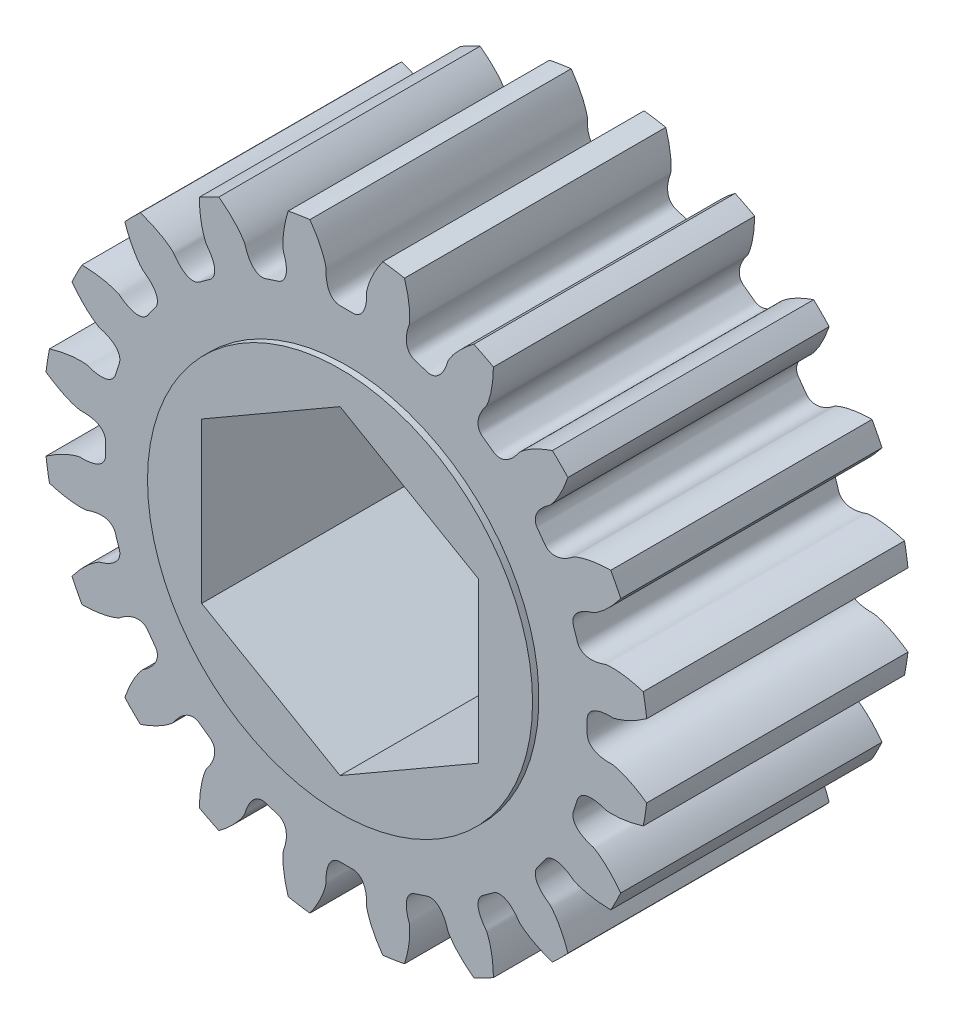
from build123d import *

# Parameters (mm, degrees)
BOSS_EXTRUDE1_DEPTH = 12.065
SKETCH2_R           = 8.89
BOSS_EXTRUDE2_DEPTH = 0.2921
BOSS_EXTRUDE3_START = 0.2921
SKETCH3_R           = 8.89
BOSS_EXTRUDE3_DEPTH = 0.2921
CUT_EXTRUDE1_DEPTH  = 24.338021171


with BuildPart() as part:
    # Sketch1 → Boss-Extrude1 (new body)
    with BuildSketch(Plane(origin=(0, 0, -6.0325), x_dir=(-1, 0, 0), z_dir=(0, 0, -1))):
        with BuildLine():
            ThreePointArc((-9.512675365, 10.230831217), (-9.878281733, 9.878281733), (-10.230831217, 9.512675365))
            add(Edge.make_bspline(
                [(-12.208592606, 6.790520347), (-12.095329691, 6.789049814), (-11.929946947, 6.782686734), (-11.715987182, 6.765537407), (-11.569261116, 6.749788038), (-11.431876081, 6.731285472), (-11.303867458, 6.710521074), (-11.185250935, 6.687985966), (-11.076022333, 6.664170625), (-10.976158721, 6.639562645), (-10.88561498, 6.614651246), (-10.80433542, 6.589909593), (-10.732217032, 6.565848579), (-10.669225937, 6.542844439), (-10.615038746, 6.52166786), (-10.556574971, 6.495929693), (-10.491487475, 6.470161531), (-10.441415192, 6.424615713), (-10.398531232, 6.393943037), (-10.36439806, 6.369378589), (-10.330387779, 6.346004023), (-10.296648729, 6.323585507), (-10.263144513, 6.302173447), (-10.22988487, 6.281744386), (-10.196865285, 6.262294419), (-10.164082457, 6.243814996), (-10.131529962, 6.226299407), (-10.099199033, 6.20974131), (-10.067077965, 6.194135393), (-10.035151824, 6.179477546), (-10.003402014, 6.165765255), (-9.971805829, 6.152998041), (-9.940335941, 6.141178039), (-9.908959842, 6.130310714), (-9.877639252, 6.120405769), (-9.846329499, 6.111478297), (-9.814978912, 6.103550219), (-9.783528272, 6.09665211), (-9.751910419, 6.090825461), (-9.720050139, 6.086125512), (-9.687864549, 6.082624709), (-9.65526428, 6.080416885), (-9.622155894, 6.079622164), (-9.588446155, 6.080392488), (-9.55404892, 6.082917433), (-9.518895632, 6.087429592), (-9.482950389, 6.094208228), (-9.446230348, 6.103579075), (-9.408831405, 6.115907232), (-9.370957427, 6.131579299), (-9.332948442, 6.150971147), (-9.295300488, 6.174398879), (-9.258663835, 6.202057943), (-9.223818856, 6.233951347), (-9.193902709, 6.267277867), (-9.118313202, 6.36845856), (-9.004080784, 6.541847615), (-8.874477752, 6.704069266), (-8.801607637, 6.807225712), (-8.779156831, 6.84597612), (-8.759592091, 6.888971268), (-8.744608106, 6.932361917), (-8.733960867, 6.975406816), (-8.727263546, 7.017547919), (-8.724062227, 7.058411147), (-8.723894363, 7.097789266), (-8.726329274, 7.135607851), (-8.730990099, 7.171888523), (-8.737561744, 7.20671562), (-8.745789709, 7.240209585), (-8.75547397, 7.272507496), (-8.766460848, 7.303749859), (-8.778634651, 7.334072303), (-8.791910006, 7.36360081), (-8.806225291, 7.392449373), (-8.821537217, 7.420719205), (-8.837816492, 7.448498908), (-8.855044406, 7.475865178), (-8.873210182, 7.502883781), (-8.892308939, 7.529610636), (-8.912340127, 7.556092891), (-8.933306348, 7.582369952), (-8.955212448, 7.608474423), (-8.978064842, 7.634432956), (-9.001871003, 7.660266997), (-9.026639068, 7.685993454), (-9.052377561, 7.711625261), (-9.07909515, 7.73717191), (-9.106800577, 7.762639776), (-9.135502207, 7.788032897), (-9.165209194, 7.81335177), (-9.195926645, 7.838599483), (-9.227673861, 7.863759524), (-9.260414148, 7.888882085), (-9.294324057, 7.913753829), (-9.336747378, 7.945060521), (-9.395537212, 7.97860766), (-9.440157332, 8.032546746), (-9.482702084, 8.08019557), (-9.51958697, 8.125186728), (-9.560930527, 8.177986149), (-9.606099718, 8.23913955), (-9.654747193, 8.308795414), (-9.706418897, 8.387209583), (-9.76068203, 8.474581238), (-9.817085259, 8.571104467), (-9.875171942, 8.676951752), (-9.934476897, 8.792278635), (-9.994528194, 8.917221961), (-10.054847583, 9.05189992), (-10.137274765, 9.250088315), (-10.194432492, 9.405410351), (-10.230831217, 9.512675365)],
                knots=[0, 0, 0, 0, 0.047933382, 0.070007965, 0.090821144, 0.110372918, 0.128663287, 0.145692252, 0.161459812, 0.175965967, 0.189210717, 0.201194063, 0.211916004, 0.22137654, 0.229575672, 0.236513398, 0.248465852, 0.258824021, 0.264865189, 0.270795102, 0.276615554, 0.282328511, 0.287936135, 0.293440809, 0.29884516, 0.304152096, 0.30936484, 0.31448697, 0.319522469, 0.324475781, 0.329351871, 0.334156301, 0.33889531, 0.343575914, 0.348206011, 0.352794505, 0.357351445, 0.361888172, 0.366417487, 0.370953817, 0.375513382, 0.380114337, 0.384776871, 0.389523214, 0.394377492, 0.399365346, 0.404513199, 0.409847051, 0.415390659, 0.421163028, 0.427175267, 0.433427087, 0.439903549, 0.446572967, 0.453386989, 0.458818602, 0.5, 0.541181398, 0.546613011, 0.553427033, 0.560096451, 0.566572913, 0.572824733, 0.578836972, 0.584609341, 0.590152949, 0.595486801, 0.600634654, 0.605622508, 0.610476786, 0.615223129, 0.619885663, 0.624486618, 0.629046183, 0.633582513, 0.638111828, 0.642648555, 0.647205495, 0.651793989, 0.656424086, 0.66110469, 0.665843699, 0.670648129, 0.675524219, 0.680477531, 0.68551303, 0.69063516, 0.695847904, 0.70115484, 0.706559191, 0.712063865, 0.717671489, 0.723384446, 0.729204898, 0.735134811, 0.741175979, 0.751534148, 0.763486602, 0.770424328, 0.77862346, 0.788083996, 0.798805937, 0.810789283, 0.824034033, 0.838540188, 0.854307748, 0.871336713, 0.889627082, 0.909178856, 0.929992035, 0.952066618, 1, 1, 1, 1], degree=3))
            ThreePointArc((-12.208592606, 6.790520347), (-12.447361143, 6.342247281), (-12.669677046, 5.88559118))
            add(Edge.make_bspline(
                [(-13.709447741, 2.685506032), (-13.601273887, 2.719107638), (-13.442019252, 2.764162068), (-13.233231989, 2.813969292), (-13.088820385, 2.844331599), (-12.952441845, 2.869188924), (-12.824281858, 2.888997649), (-12.70450711, 2.904220008), (-12.593265191, 2.915323768), (-12.490684968, 2.922779741), (-12.396874707, 2.927067147), (-12.311927661, 2.928653202), (-12.235903736, 2.928055626), (-12.168886974, 2.925642708), (-12.110807971, 2.922247347), (-12.047252085, 2.915835196), (-11.977387399, 2.911441359), (-11.915691396, 2.883597899), (-11.865427948, 2.867678323), (-11.82537454, 2.854863874), (-11.785805703, 2.843143096), (-11.746790257, 2.83224776), (-11.708309163, 2.822237054), (-11.670364436, 2.813085657), (-11.632950574, 2.804791252), (-11.596061797, 2.797346727), (-11.559689919, 2.790747687), (-11.523824645, 2.784990807), (-11.488453201, 2.780074653), (-11.453560112, 2.775999933), (-11.419126917, 2.77277), (-11.385131874, 2.770391416), (-11.35154965, 2.768874656), (-11.318351018, 2.768234964), (-11.285502571, 2.768493396), (-11.252966486, 2.769678111), (-11.220700396, 2.771825925), (-11.188657426, 2.774984215), (-11.156786527, 2.779213197), (-11.125033236, 2.784588648), (-11.093341114, 2.791205081), (-11.06165416, 2.799179353), (-11.029920632, 2.808654582), (-10.998098808, 2.819804086), (-10.966165345, 2.832834781), (-10.934126915, 2.847989063), (-10.902035671, 2.86554362), (-10.870008588, 2.885802942), (-10.838249689, 2.909084625), (-10.807072331, 2.935693349), (-10.776916049, 2.965881515), (-10.748350284, 2.999796469), (-10.722053877, 3.037423151), (-10.698769937, 3.078523271), (-10.680616451, 3.119463274), (-10.639993112, 3.239050273), (-10.584931791, 3.439252822), (-10.511801229, 3.63358432), (-10.474374727, 3.754210034), (-10.464997275, 3.798001542), (-10.459676334, 3.844938195), (-10.458834165, 3.89083546), (-10.462009645, 3.93506377), (-10.46866243, 3.977211927), (-10.478245228, 4.017064428), (-10.490254087, 4.054567118), (-10.504256411, 4.0897823), (-10.519900463, 4.122846996), (-10.536912634, 4.153938783), (-10.555088098, 4.183250856), (-10.57427898, 4.210975393), (-10.594382544, 4.237293514), (-10.615330668, 4.26236996), (-10.637081092, 4.286350929), (-10.659610434, 4.309363876), (-10.682908799, 4.331518439), (-10.70697571, 4.352907934), (-10.731817072, 4.373611085), (-10.757442959, 4.39369377), (-10.783866009, 4.413210679), (-10.811100268, 4.432206823), (-10.839160387, 4.450718874), (-10.868061051, 4.468776345), (-10.897816598, 4.486402598), (-10.92844076, 4.503615723), (-10.959946502, 4.520429284), (-10.992345927, 4.53685295), (-11.025650213, 4.552893067), (-11.059869643, 4.568553), (-11.095013422, 4.583834001), (-11.131090407, 4.598733717), (-11.168106411, 4.613253505), (-11.206074688, 4.627371696), (-11.24497585, 4.641147366), (-11.284911882, 4.654323063), (-11.334933157, 4.670987968), (-11.401212248, 4.684726136), (-11.460316599, 4.72223688), (-11.515503358, 4.754406553), (-11.564486002, 4.78579763), (-11.620121979, 4.823237002), (-11.681977873, 4.867439295), (-11.749769217, 4.918653062), (-11.823143238, 4.977261934), (-11.901749871, 5.043589085), (-11.985219847, 5.117958575), (-12.073172176, 5.200675553), (-12.165212507, 5.292031698), (-12.260934295, 5.392302991), (-12.35991922, 5.501749624), (-12.499555712, 5.664766589), (-12.601913089, 5.794823915), (-12.669677046, 5.88559118)],
                knots=[0, 0, 0, 0, 0.047933382, 0.070007965, 0.090821144, 0.110372918, 0.128663287, 0.145692252, 0.161459812, 0.175965967, 0.189210717, 0.201194063, 0.211916004, 0.22137654, 0.229575672, 0.236513398, 0.248465852, 0.258824021, 0.264865189, 0.270795102, 0.276615554, 0.282328511, 0.287936135, 0.293440809, 0.29884516, 0.304152096, 0.30936484, 0.31448697, 0.319522469, 0.324475781, 0.329351871, 0.334156301, 0.33889531, 0.343575914, 0.348206011, 0.352794505, 0.357351445, 0.361888172, 0.366417487, 0.370953817, 0.375513382, 0.380114337, 0.384776871, 0.389523214, 0.394377492, 0.399365346, 0.404513199, 0.409847051, 0.415390659, 0.421163028, 0.427175267, 0.433427087, 0.439903549, 0.446572967, 0.453386989, 0.458818602, 0.5, 0.541181398, 0.546613011, 0.553427033, 0.560096451, 0.566572913, 0.572824733, 0.578836972, 0.584609341, 0.590152949, 0.595486801, 0.600634654, 0.605622508, 0.610476786, 0.615223129, 0.619885663, 0.624486618, 0.629046183, 0.633582513, 0.638111828, 0.642648555, 0.647205495, 0.651793989, 0.656424086, 0.66110469, 0.665843699, 0.670648129, 0.675524219, 0.680477531, 0.68551303, 0.69063516, 0.695847904, 0.70115484, 0.706559191, 0.712063865, 0.717671489, 0.723384446, 0.729204898, 0.735134811, 0.741175979, 0.751534148, 0.763486602, 0.770424328, 0.77862346, 0.788083996, 0.798805937, 0.810789283, 0.824034033, 0.838540188, 0.854307748, 0.871336713, 0.889627082, 0.909178856, 0.929992035, 0.952066618, 1, 1, 1, 1], degree=3))
            ThreePointArc((-13.709447741, 2.685506032), (-13.798006118, 2.185389477), (-13.868326611, 1.682384324))
            add(Edge.make_bspline(
                [(-13.868326611, -1.682384324), (-13.77583063, -1.616999739), (-13.638293056, -1.524938041), (-13.455115848, -1.413049743), (-13.32715472, -1.339547833), (-13.205132356, -1.273763826), (-13.089366198, -1.215320995), (-12.980157611, -1.163831239), (-12.87779151, -1.118895292), (-12.782535943, -1.080105208), (-12.694641964, -1.047038678), (-12.61434264, -1.019280169), (-12.54185493, -0.996355812), (-12.477372569, -0.977941316), (-12.42108693, -0.963223097), (-12.358660227, -0.949681567), (-12.290857192, -0.932270978), (-12.223576704, -0.939686569), (-12.170853905, -0.939294726), (-12.128800968, -0.939104807), (-12.087546848, -0.938024486), (-12.047074109, -0.936330131), (-12.007382936, -0.933959566), (-11.968467419, -0.930937496), (-11.93032161, -0.927264425), (-11.892937813, -0.92294533), (-11.856306886, -0.917981862), (-11.82041801, -0.912374001), (-11.785258592, -0.906119163), (-11.750814135, -0.899211895), (-11.717068117, -0.891643302), (-11.684001886, -0.883400423), (-11.651594589, -0.87446547), (-11.619823138, -0.864814912), (-11.588662268, -0.8544184), (-11.55808471, -0.843237466), (-11.528061545, -0.831224003), (-11.498562836, -0.818318468), (-11.469558637, -0.804447818), (-11.441020568, -0.789523154), (-11.412924159, -0.773437148), (-11.38525226, -0.756061357), (-11.357999889, -0.73724368), (-11.331180922, -0.716806387), (-11.304837099, -0.694545476), (-11.279049673, -0.670232479), (-11.253953742, -0.643620363), (-11.229754651, -0.61445569), (-11.206744579, -0.582499454), (-11.185315697, -0.547558721), (-11.165964025, -0.509529265), (-11.149276665, -0.46844692), (-11.13589458, -0.424535782), (-11.126450873, -0.378252112), (-11.121837039, -0.33370612), (-11.120156362, -0.207418823), (-11.129655924, 0), (-11.120156362, 0.207418823), (-11.121837039, 0.33370612), (-11.126450873, 0.378252112), (-11.13589458, 0.424535782), (-11.149276665, 0.46844692), (-11.165964025, 0.509529265), (-11.185315697, 0.547558721), (-11.206744579, 0.582499454), (-11.229754651, 0.61445569), (-11.253953742, 0.643620363), (-11.279049673, 0.670232479), (-11.304837099, 0.694545476), (-11.331180922, 0.716806387), (-11.357999889, 0.73724368), (-11.38525226, 0.756061357), (-11.412924159, 0.773437148), (-11.441020568, 0.789523154), (-11.469558637, 0.804447818), (-11.498562836, 0.818318468), (-11.528061545, 0.831224003), (-11.55808471, 0.843237466), (-11.588662268, 0.8544184), (-11.619823138, 0.864814912), (-11.651594589, 0.87446547), (-11.684001886, 0.883400423), (-11.717068117, 0.891643302), (-11.750814135, 0.899211895), (-11.785258592, 0.906119163), (-11.82041801, 0.912374001), (-11.856306886, 0.917981862), (-11.892937813, 0.92294533), (-11.93032161, 0.927264425), (-11.968467419, 0.930937496), (-12.007382936, 0.933959566), (-12.047074109, 0.936330131), (-12.087546848, 0.938024486), (-12.128800968, 0.939104807), (-12.170853905, 0.939294726), (-12.223576704, 0.939686569), (-12.290857192, 0.932270978), (-12.358660227, 0.949681567), (-12.42108693, 0.963223097), (-12.477372569, 0.977941316), (-12.54185493, 0.996355812), (-12.61434264, 1.019280169), (-12.694641964, 1.047038678), (-12.782535943, 1.080105208), (-12.87779151, 1.118895292), (-12.980157611, 1.163831239), (-13.089366198, 1.215320995), (-13.205132356, 1.273763826), (-13.32715472, 1.339547833), (-13.455115848, 1.413049743), (-13.638293056, 1.524938041), (-13.77583063, 1.616999739), (-13.868326611, 1.682384324)],
                knots=[0, 0, 0, 0, 0.047933382, 0.070007965, 0.090821144, 0.110372918, 0.128663287, 0.145692252, 0.161459812, 0.175965967, 0.189210717, 0.201194063, 0.211916004, 0.22137654, 0.229575672, 0.236513398, 0.248465852, 0.258824021, 0.264865189, 0.270795102, 0.276615554, 0.282328511, 0.287936135, 0.293440809, 0.29884516, 0.304152096, 0.30936484, 0.31448697, 0.319522469, 0.324475781, 0.329351871, 0.334156301, 0.33889531, 0.343575914, 0.348206011, 0.352794505, 0.357351445, 0.361888172, 0.366417487, 0.370953817, 0.375513382, 0.380114337, 0.384776871, 0.389523214, 0.394377492, 0.399365346, 0.404513199, 0.409847051, 0.415390659, 0.421163028, 0.427175267, 0.433427087, 0.439903549, 0.446572967, 0.453386989, 0.458818602, 0.5, 0.541181398, 0.546613011, 0.553427033, 0.560096451, 0.566572913, 0.572824733, 0.578836972, 0.584609341, 0.590152949, 0.595486801, 0.600634654, 0.605622508, 0.610476786, 0.615223129, 0.619885663, 0.624486618, 0.629046183, 0.633582513, 0.638111828, 0.642648555, 0.647205495, 0.651793989, 0.656424086, 0.66110469, 0.665843699, 0.670648129, 0.675524219, 0.680477531, 0.68551303, 0.69063516, 0.695847904, 0.70115484, 0.706559191, 0.712063865, 0.717671489, 0.723384446, 0.729204898, 0.735134811, 0.741175979, 0.751534148, 0.763486602, 0.770424328, 0.77862346, 0.788083996, 0.798805937, 0.810789283, 0.824034033, 0.838540188, 0.854307748, 0.871336713, 0.889627082, 0.909178856, 0.929992035, 0.952066618, 1, 1, 1, 1], degree=3))
            ThreePointArc((-13.868326611, -1.682384324), (-13.798006118, -2.185389477), (-13.709447741, -2.685506032))
            add(Edge.make_bspline(
                [(-12.669677046, -5.88559118), (-12.601913089, -5.794823915), (-12.499555712, -5.664766589), (-12.35991922, -5.501749624), (-12.260934295, -5.392302991), (-12.165212507, -5.292031698), (-12.073172176, -5.200675553), (-11.985219847, -5.117958575), (-11.901749871, -5.043589085), (-11.823143238, -4.977261934), (-11.749769217, -4.918653062), (-11.681977873, -4.867439295), (-11.620121979, -4.823237002), (-11.564486002, -4.78579763), (-11.515503358, -4.754406553), (-11.460316599, -4.72223688), (-11.401212248, -4.684726136), (-11.334933157, -4.670987968), (-11.284911882, -4.654323063), (-11.24497585, -4.641147366), (-11.206074688, -4.627371696), (-11.168106411, -4.613253505), (-11.131090407, -4.598733717), (-11.095013422, -4.583834001), (-11.059869643, -4.568553), (-11.025650213, -4.552893067), (-10.992345927, -4.53685295), (-10.959946502, -4.520429284), (-10.92844076, -4.503615723), (-10.897816598, -4.486402598), (-10.868061051, -4.468776345), (-10.839160387, -4.450718874), (-10.811100268, -4.432206823), (-10.783866009, -4.413210679), (-10.757442959, -4.39369377), (-10.731817072, -4.373611085), (-10.70697571, -4.352907934), (-10.682908799, -4.331518439), (-10.659610434, -4.309363876), (-10.637081092, -4.286350929), (-10.615330668, -4.26236996), (-10.594382544, -4.237293514), (-10.57427898, -4.210975393), (-10.555088098, -4.183250856), (-10.536912634, -4.153938783), (-10.519900463, -4.122846996), (-10.504256411, -4.0897823), (-10.490254087, -4.054567118), (-10.478245228, -4.017064428), (-10.46866243, -3.977211927), (-10.462009645, -3.93506377), (-10.458834165, -3.89083546), (-10.459676334, -3.844938195), (-10.464997275, -3.798001542), (-10.474374727, -3.754210034), (-10.511801229, -3.63358432), (-10.584931791, -3.439252822), (-10.639993112, -3.239050273), (-10.680616451, -3.119463274), (-10.698769937, -3.078523271), (-10.722053877, -3.037423151), (-10.748350284, -2.999796469), (-10.776916049, -2.965881515), (-10.807072331, -2.935693349), (-10.838249689, -2.909084625), (-10.870008588, -2.885802942), (-10.902035671, -2.86554362), (-10.934126915, -2.847989063), (-10.966165345, -2.832834781), (-10.998098808, -2.819804086), (-11.029920632, -2.808654582), (-11.06165416, -2.799179353), (-11.093341114, -2.791205081), (-11.125033236, -2.784588648), (-11.156786527, -2.779213197), (-11.188657426, -2.774984215), (-11.220700396, -2.771825925), (-11.252966486, -2.769678111), (-11.285502571, -2.768493396), (-11.318351018, -2.768234964), (-11.35154965, -2.768874656), (-11.385131874, -2.770391416), (-11.419126917, -2.77277), (-11.453560112, -2.775999933), (-11.488453201, -2.780074653), (-11.523824645, -2.784990807), (-11.559689919, -2.790747687), (-11.596061797, -2.797346727), (-11.632950574, -2.804791252), (-11.670364436, -2.813085657), (-11.708309163, -2.822237054), (-11.746790257, -2.83224776), (-11.785805703, -2.843143096), (-11.82537454, -2.854863874), (-11.865427948, -2.867678323), (-11.915691396, -2.883597899), (-11.977387399, -2.911441359), (-12.047252085, -2.915835196), (-12.110807971, -2.922247347), (-12.168886974, -2.925642708), (-12.235903736, -2.928055626), (-12.311927661, -2.928653202), (-12.396874707, -2.927067147), (-12.490684968, -2.922779741), (-12.593265191, -2.915323768), (-12.70450711, -2.904220008), (-12.824281858, -2.888997649), (-12.952441845, -2.869188924), (-13.088820385, -2.844331599), (-13.233231989, -2.813969292), (-13.442019252, -2.764162068), (-13.601273887, -2.719107638), (-13.709447741, -2.685506032)],
                knots=[0, 0, 0, 0, 0.047933382, 0.070007965, 0.090821144, 0.110372918, 0.128663287, 0.145692252, 0.161459812, 0.175965967, 0.189210717, 0.201194063, 0.211916004, 0.22137654, 0.229575672, 0.236513398, 0.248465852, 0.258824021, 0.264865189, 0.270795102, 0.276615554, 0.282328511, 0.287936135, 0.293440809, 0.29884516, 0.304152096, 0.30936484, 0.31448697, 0.319522469, 0.324475781, 0.329351871, 0.334156301, 0.33889531, 0.343575914, 0.348206011, 0.352794505, 0.357351445, 0.361888172, 0.366417487, 0.370953817, 0.375513382, 0.380114337, 0.384776871, 0.389523214, 0.394377492, 0.399365346, 0.404513199, 0.409847051, 0.415390659, 0.421163028, 0.427175267, 0.433427087, 0.439903549, 0.446572967, 0.453386989, 0.458818602, 0.5, 0.541181398, 0.546613011, 0.553427033, 0.560096451, 0.566572913, 0.572824733, 0.578836972, 0.584609341, 0.590152949, 0.595486801, 0.600634654, 0.605622508, 0.610476786, 0.615223129, 0.619885663, 0.624486618, 0.629046183, 0.633582513, 0.638111828, 0.642648555, 0.647205495, 0.651793989, 0.656424086, 0.66110469, 0.665843699, 0.670648129, 0.675524219, 0.680477531, 0.68551303, 0.69063516, 0.695847904, 0.70115484, 0.706559191, 0.712063865, 0.717671489, 0.723384446, 0.729204898, 0.735134811, 0.741175979, 0.751534148, 0.763486602, 0.770424328, 0.77862346, 0.788083996, 0.798805937, 0.810789283, 0.824034033, 0.838540188, 0.854307748, 0.871336713, 0.889627082, 0.909178856, 0.929992035, 0.952066618, 1, 1, 1, 1], degree=3))
            ThreePointArc((-12.669677046, -5.88559118), (-12.447361143, -6.342247281), (-12.208592606, -6.790520347))
            add(Edge.make_bspline(
                [(-10.230831217, -9.512675365), (-10.194432492, -9.405410351), (-10.137274765, -9.250088315), (-10.054847583, -9.05189992), (-9.994528194, -8.917221961), (-9.934476897, -8.792278635), (-9.875171942, -8.676951752), (-9.817085259, -8.571104467), (-9.76068203, -8.474581238), (-9.706418897, -8.387209583), (-9.654747193, -8.308795414), (-9.606099718, -8.23913955), (-9.560930527, -8.177986149), (-9.51958697, -8.125186728), (-9.482702084, -8.08019557), (-9.440157332, -8.032546746), (-9.395537212, -7.97860766), (-9.336747378, -7.945060521), (-9.294324057, -7.913753829), (-9.260414148, -7.888882085), (-9.227673861, -7.863759524), (-9.195926645, -7.838599483), (-9.165209194, -7.81335177), (-9.135502207, -7.788032897), (-9.106800577, -7.762639776), (-9.07909515, -7.73717191), (-9.052377561, -7.711625261), (-9.026639068, -7.685993454), (-9.001871003, -7.660266997), (-8.978064842, -7.634432956), (-8.955212448, -7.608474423), (-8.933306348, -7.582369952), (-8.912340127, -7.556092891), (-8.892308939, -7.529610636), (-8.873210182, -7.502883781), (-8.855044406, -7.475865178), (-8.837816492, -7.448498908), (-8.821537217, -7.420719205), (-8.806225291, -7.392449373), (-8.791910006, -7.36360081), (-8.778634651, -7.334072303), (-8.766460848, -7.303749859), (-8.75547397, -7.272507496), (-8.745789709, -7.240209585), (-8.737561744, -7.20671562), (-8.730990099, -7.171888523), (-8.726329274, -7.135607851), (-8.723894363, -7.097789266), (-8.724062227, -7.058411147), (-8.727263546, -7.017547919), (-8.733960867, -6.975406816), (-8.744608106, -6.932361917), (-8.759592091, -6.888971268), (-8.779156831, -6.84597612), (-8.801607637, -6.807225712), (-8.874477752, -6.704069266), (-9.004080784, -6.541847615), (-9.118313202, -6.36845856), (-9.193902709, -6.267277867), (-9.223818856, -6.233951347), (-9.258663835, -6.202057943), (-9.295300488, -6.174398879), (-9.332948442, -6.150971147), (-9.370957427, -6.131579299), (-9.408831405, -6.115907232), (-9.446230348, -6.103579075), (-9.482950389, -6.094208228), (-9.518895632, -6.087429592), (-9.55404892, -6.082917433), (-9.588446155, -6.080392488), (-9.622155894, -6.079622164), (-9.65526428, -6.080416885), (-9.687864549, -6.082624709), (-9.720050139, -6.086125512), (-9.751910419, -6.090825461), (-9.783528272, -6.09665211), (-9.814978912, -6.103550219), (-9.846329499, -6.111478297), (-9.877639252, -6.120405769), (-9.908959842, -6.130310714), (-9.940335941, -6.141178039), (-9.971805829, -6.152998041), (-10.003402014, -6.165765255), (-10.035151824, -6.179477546), (-10.067077965, -6.194135393), (-10.099199033, -6.20974131), (-10.131529962, -6.226299407), (-10.164082457, -6.243814996), (-10.196865285, -6.262294419), (-10.22988487, -6.281744386), (-10.263144513, -6.302173447), (-10.296648729, -6.323585507), (-10.330387779, -6.346004023), (-10.36439806, -6.369378589), (-10.398531232, -6.393943037), (-10.441415192, -6.424615713), (-10.491487475, -6.470161531), (-10.556574971, -6.495929693), (-10.615038746, -6.52166786), (-10.669225937, -6.542844439), (-10.732217032, -6.565848579), (-10.80433542, -6.589909593), (-10.88561498, -6.614651246), (-10.976158721, -6.639562645), (-11.076022333, -6.664170625), (-11.185250935, -6.687985966), (-11.303867458, -6.710521074), (-11.431876081, -6.731285472), (-11.569261116, -6.749788038), (-11.715987182, -6.765537407), (-11.929946947, -6.782686734), (-12.095329691, -6.789049814), (-12.208592606, -6.790520347)],
                knots=[0, 0, 0, 0, 0.047933382, 0.070007965, 0.090821144, 0.110372918, 0.128663287, 0.145692252, 0.161459812, 0.175965967, 0.189210717, 0.201194063, 0.211916004, 0.22137654, 0.229575672, 0.236513398, 0.248465852, 0.258824021, 0.264865189, 0.270795102, 0.276615554, 0.282328511, 0.287936135, 0.293440809, 0.29884516, 0.304152096, 0.30936484, 0.31448697, 0.319522469, 0.324475781, 0.329351871, 0.334156301, 0.33889531, 0.343575914, 0.348206011, 0.352794505, 0.357351445, 0.361888172, 0.366417487, 0.370953817, 0.375513382, 0.380114337, 0.384776871, 0.389523214, 0.394377492, 0.399365346, 0.404513199, 0.409847051, 0.415390659, 0.421163028, 0.427175267, 0.433427087, 0.439903549, 0.446572967, 0.453386989, 0.458818602, 0.5, 0.541181398, 0.546613011, 0.553427033, 0.560096451, 0.566572913, 0.572824733, 0.578836972, 0.584609341, 0.590152949, 0.595486801, 0.600634654, 0.605622508, 0.610476786, 0.615223129, 0.619885663, 0.624486618, 0.629046183, 0.633582513, 0.638111828, 0.642648555, 0.647205495, 0.651793989, 0.656424086, 0.66110469, 0.665843699, 0.670648129, 0.675524219, 0.680477531, 0.68551303, 0.69063516, 0.695847904, 0.70115484, 0.706559191, 0.712063865, 0.717671489, 0.723384446, 0.729204898, 0.735134811, 0.741175979, 0.751534148, 0.763486602, 0.770424328, 0.77862346, 0.788083996, 0.798805937, 0.810789283, 0.824034033, 0.838540188, 0.854307748, 0.871336713, 0.889627082, 0.909178856, 0.929992035, 0.952066618, 1, 1, 1, 1], degree=3))
            ThreePointArc((-10.230831217, -9.512675365), (-9.878281733, -9.878281733), (-9.512675365, -10.230831217))
            add(Edge.make_bspline(
                [(-6.790520347, -12.208592606), (-6.789049814, -12.095329691), (-6.782686734, -11.929946947), (-6.765537407, -11.715987182), (-6.749788038, -11.569261116), (-6.731285472, -11.431876081), (-6.710521074, -11.303867458), (-6.687985966, -11.185250935), (-6.664170625, -11.076022333), (-6.639562645, -10.976158721), (-6.614651246, -10.88561498), (-6.589909593, -10.80433542), (-6.565848579, -10.732217032), (-6.542844439, -10.669225937), (-6.52166786, -10.615038746), (-6.495929693, -10.556574971), (-6.470161531, -10.491487475), (-6.424615713, -10.441415192), (-6.393943037, -10.398531232), (-6.369378589, -10.36439806), (-6.346004023, -10.330387779), (-6.323585507, -10.296648729), (-6.302173447, -10.263144513), (-6.281744386, -10.22988487), (-6.262294419, -10.196865285), (-6.243814996, -10.164082457), (-6.226299407, -10.131529962), (-6.20974131, -10.099199033), (-6.194135393, -10.067077965), (-6.179477546, -10.035151824), (-6.165765255, -10.003402014), (-6.152998041, -9.971805829), (-6.141178039, -9.940335941), (-6.130310714, -9.908959842), (-6.120405769, -9.877639252), (-6.111478297, -9.846329499), (-6.103550219, -9.814978912), (-6.09665211, -9.783528272), (-6.090825461, -9.751910419), (-6.086125512, -9.720050139), (-6.082624709, -9.687864549), (-6.080416885, -9.65526428), (-6.079622164, -9.622155894), (-6.080392488, -9.588446155), (-6.082917433, -9.55404892), (-6.087429592, -9.518895632), (-6.094208228, -9.482950389), (-6.103579075, -9.446230348), (-6.115907232, -9.408831405), (-6.131579299, -9.370957427), (-6.150971147, -9.332948442), (-6.174398879, -9.295300488), (-6.202057943, -9.258663835), (-6.233951347, -9.223818856), (-6.267277867, -9.193902709), (-6.36845856, -9.118313202), (-6.541847615, -9.004080784), (-6.704069266, -8.874477752), (-6.807225712, -8.801607637), (-6.84597612, -8.779156831), (-6.888971268, -8.759592091), (-6.932361917, -8.744608106), (-6.975406816, -8.733960867), (-7.017547919, -8.727263546), (-7.058411147, -8.724062227), (-7.097789266, -8.723894363), (-7.135607851, -8.726329274), (-7.171888523, -8.730990099), (-7.20671562, -8.737561744), (-7.240209585, -8.745789709), (-7.272507496, -8.75547397), (-7.303749859, -8.766460848), (-7.334072303, -8.778634651), (-7.36360081, -8.791910006), (-7.392449373, -8.806225291), (-7.420719205, -8.821537217), (-7.448498908, -8.837816492), (-7.475865178, -8.855044406), (-7.502883781, -8.873210182), (-7.529610636, -8.892308939), (-7.556092891, -8.912340127), (-7.582369952, -8.933306348), (-7.608474423, -8.955212448), (-7.634432956, -8.978064842), (-7.660266997, -9.001871003), (-7.685993454, -9.026639068), (-7.711625261, -9.052377561), (-7.73717191, -9.07909515), (-7.762639776, -9.106800577), (-7.788032897, -9.135502207), (-7.81335177, -9.165209194), (-7.838599483, -9.195926645), (-7.863759524, -9.227673861), (-7.888882085, -9.260414148), (-7.913753829, -9.294324057), (-7.945060521, -9.336747378), (-7.97860766, -9.395537212), (-8.032546746, -9.440157332), (-8.08019557, -9.482702084), (-8.125186728, -9.51958697), (-8.177986149, -9.560930527), (-8.23913955, -9.606099718), (-8.308795414, -9.654747193), (-8.387209583, -9.706418897), (-8.474581238, -9.76068203), (-8.571104467, -9.817085259), (-8.676951752, -9.875171942), (-8.792278635, -9.934476897), (-8.917221961, -9.994528194), (-9.05189992, -10.054847583), (-9.250088315, -10.137274765), (-9.405410351, -10.194432492), (-9.512675365, -10.230831217)],
                knots=[0, 0, 0, 0, 0.047933382, 0.070007965, 0.090821144, 0.110372918, 0.128663287, 0.145692252, 0.161459812, 0.175965967, 0.189210717, 0.201194063, 0.211916004, 0.22137654, 0.229575672, 0.236513398, 0.248465852, 0.258824021, 0.264865189, 0.270795102, 0.276615554, 0.282328511, 0.287936135, 0.293440809, 0.29884516, 0.304152096, 0.30936484, 0.31448697, 0.319522469, 0.324475781, 0.329351871, 0.334156301, 0.33889531, 0.343575914, 0.348206011, 0.352794505, 0.357351445, 0.361888172, 0.366417487, 0.370953817, 0.375513382, 0.380114337, 0.384776871, 0.389523214, 0.394377492, 0.399365346, 0.404513199, 0.409847051, 0.415390659, 0.421163028, 0.427175267, 0.433427087, 0.439903549, 0.446572967, 0.453386989, 0.458818602, 0.5, 0.541181398, 0.546613011, 0.553427033, 0.560096451, 0.566572913, 0.572824733, 0.578836972, 0.584609341, 0.590152949, 0.595486801, 0.600634654, 0.605622508, 0.610476786, 0.615223129, 0.619885663, 0.624486618, 0.629046183, 0.633582513, 0.638111828, 0.642648555, 0.647205495, 0.651793989, 0.656424086, 0.66110469, 0.665843699, 0.670648129, 0.675524219, 0.680477531, 0.68551303, 0.69063516, 0.695847904, 0.70115484, 0.706559191, 0.712063865, 0.717671489, 0.723384446, 0.729204898, 0.735134811, 0.741175979, 0.751534148, 0.763486602, 0.770424328, 0.77862346, 0.788083996, 0.798805937, 0.810789283, 0.824034033, 0.838540188, 0.854307748, 0.871336713, 0.889627082, 0.909178856, 0.929992035, 0.952066618, 1, 1, 1, 1], degree=3))
            ThreePointArc((-6.790520347, -12.208592606), (-6.342247281, -12.447361143), (-5.88559118, -12.669677046))
            add(Edge.make_bspline(
                [(-2.685506032, -13.709447741), (-2.719107638, -13.601273887), (-2.764162068, -13.442019252), (-2.813969292, -13.233231989), (-2.844331599, -13.088820385), (-2.869188924, -12.952441845), (-2.888997649, -12.824281858), (-2.904220008, -12.70450711), (-2.915323768, -12.593265191), (-2.922779741, -12.490684968), (-2.927067147, -12.396874707), (-2.928653202, -12.311927661), (-2.928055626, -12.235903736), (-2.925642708, -12.168886974), (-2.922247347, -12.110807971), (-2.915835196, -12.047252085), (-2.911441359, -11.977387399), (-2.883597899, -11.915691396), (-2.867678323, -11.865427948), (-2.854863874, -11.82537454), (-2.843143096, -11.785805703), (-2.83224776, -11.746790257), (-2.822237054, -11.708309163), (-2.813085657, -11.670364436), (-2.804791252, -11.632950574), (-2.797346727, -11.596061797), (-2.790747687, -11.559689919), (-2.784990807, -11.523824645), (-2.780074653, -11.488453201), (-2.775999933, -11.453560112), (-2.77277, -11.419126917), (-2.770391416, -11.385131874), (-2.768874656, -11.35154965), (-2.768234964, -11.318351018), (-2.768493396, -11.285502571), (-2.769678111, -11.252966486), (-2.771825925, -11.220700396), (-2.774984215, -11.188657426), (-2.779213197, -11.156786527), (-2.784588648, -11.125033236), (-2.791205081, -11.093341114), (-2.799179353, -11.06165416), (-2.808654582, -11.029920632), (-2.819804086, -10.998098808), (-2.832834781, -10.966165345), (-2.847989063, -10.934126915), (-2.86554362, -10.902035671), (-2.885802942, -10.870008588), (-2.909084625, -10.838249689), (-2.935693349, -10.807072331), (-2.965881515, -10.776916049), (-2.999796469, -10.748350284), (-3.037423151, -10.722053877), (-3.078523271, -10.698769937), (-3.119463274, -10.680616451), (-3.239050273, -10.639993112), (-3.439252822, -10.584931791), (-3.63358432, -10.511801229), (-3.754210034, -10.474374727), (-3.798001542, -10.464997275), (-3.844938195, -10.459676334), (-3.89083546, -10.458834165), (-3.93506377, -10.462009645), (-3.977211927, -10.46866243), (-4.017064428, -10.478245228), (-4.054567118, -10.490254087), (-4.0897823, -10.504256411), (-4.122846996, -10.519900463), (-4.153938783, -10.536912634), (-4.183250856, -10.555088098), (-4.210975393, -10.57427898), (-4.237293514, -10.594382544), (-4.26236996, -10.615330668), (-4.286350929, -10.637081092), (-4.309363876, -10.659610434), (-4.331518439, -10.682908799), (-4.352907934, -10.70697571), (-4.373611085, -10.731817072), (-4.39369377, -10.757442959), (-4.413210679, -10.783866009), (-4.432206823, -10.811100268), (-4.450718874, -10.839160387), (-4.468776345, -10.868061051), (-4.486402598, -10.897816598), (-4.503615723, -10.92844076), (-4.520429284, -10.959946502), (-4.53685295, -10.992345927), (-4.552893067, -11.025650213), (-4.568553, -11.059869643), (-4.583834001, -11.095013422), (-4.598733717, -11.131090407), (-4.613253505, -11.168106411), (-4.627371696, -11.206074688), (-4.641147366, -11.24497585), (-4.654323063, -11.284911882), (-4.670987968, -11.334933157), (-4.684726136, -11.401212248), (-4.72223688, -11.460316599), (-4.754406553, -11.515503358), (-4.78579763, -11.564486002), (-4.823237002, -11.620121979), (-4.867439295, -11.681977873), (-4.918653062, -11.749769217), (-4.977261934, -11.823143238), (-5.043589085, -11.901749871), (-5.117958575, -11.985219847), (-5.200675553, -12.073172176), (-5.292031698, -12.165212507), (-5.392302991, -12.260934295), (-5.501749624, -12.35991922), (-5.664766589, -12.499555712), (-5.794823915, -12.601913089), (-5.88559118, -12.669677046)],
                knots=[0, 0, 0, 0, 0.047933382, 0.070007965, 0.090821144, 0.110372918, 0.128663287, 0.145692252, 0.161459812, 0.175965967, 0.189210717, 0.201194063, 0.211916004, 0.22137654, 0.229575672, 0.236513398, 0.248465852, 0.258824021, 0.264865189, 0.270795102, 0.276615554, 0.282328511, 0.287936135, 0.293440809, 0.29884516, 0.304152096, 0.30936484, 0.31448697, 0.319522469, 0.324475781, 0.329351871, 0.334156301, 0.33889531, 0.343575914, 0.348206011, 0.352794505, 0.357351445, 0.361888172, 0.366417487, 0.370953817, 0.375513382, 0.380114337, 0.384776871, 0.389523214, 0.394377492, 0.399365346, 0.404513199, 0.409847051, 0.415390659, 0.421163028, 0.427175267, 0.433427087, 0.439903549, 0.446572967, 0.453386989, 0.458818602, 0.5, 0.541181398, 0.546613011, 0.553427033, 0.560096451, 0.566572913, 0.572824733, 0.578836972, 0.584609341, 0.590152949, 0.595486801, 0.600634654, 0.605622508, 0.610476786, 0.615223129, 0.619885663, 0.624486618, 0.629046183, 0.633582513, 0.638111828, 0.642648555, 0.647205495, 0.651793989, 0.656424086, 0.66110469, 0.665843699, 0.670648129, 0.675524219, 0.680477531, 0.68551303, 0.69063516, 0.695847904, 0.70115484, 0.706559191, 0.712063865, 0.717671489, 0.723384446, 0.729204898, 0.735134811, 0.741175979, 0.751534148, 0.763486602, 0.770424328, 0.77862346, 0.788083996, 0.798805937, 0.810789283, 0.824034033, 0.838540188, 0.854307748, 0.871336713, 0.889627082, 0.909178856, 0.929992035, 0.952066618, 1, 1, 1, 1], degree=3))
            ThreePointArc((-2.685506032, -13.709447741), (-2.185389477, -13.798006118), (-1.682384324, -13.868326611))
            add(Edge.make_bspline(
                [(1.682384324, -13.868326611), (1.616999739, -13.77583063), (1.524938041, -13.638293056), (1.413049743, -13.455115848), (1.339547833, -13.32715472), (1.273763826, -13.205132356), (1.215320995, -13.089366198), (1.163831239, -12.980157611), (1.118895292, -12.87779151), (1.080105208, -12.782535943), (1.047038678, -12.694641964), (1.019280169, -12.61434264), (0.996355812, -12.54185493), (0.977941316, -12.477372569), (0.963223097, -12.42108693), (0.949681567, -12.358660227), (0.932270978, -12.290857192), (0.939686569, -12.223576704), (0.939294726, -12.170853905), (0.939104807, -12.128800968), (0.938024486, -12.087546848), (0.936330131, -12.047074109), (0.933959566, -12.007382936), (0.930937496, -11.968467419), (0.927264425, -11.93032161), (0.92294533, -11.892937813), (0.917981862, -11.856306886), (0.912374001, -11.82041801), (0.906119163, -11.785258592), (0.899211895, -11.750814135), (0.891643302, -11.717068117), (0.883400423, -11.684001886), (0.87446547, -11.651594589), (0.864814912, -11.619823138), (0.8544184, -11.588662268), (0.843237466, -11.55808471), (0.831224003, -11.528061545), (0.818318468, -11.498562836), (0.804447818, -11.469558637), (0.789523154, -11.441020568), (0.773437148, -11.412924159), (0.756061357, -11.38525226), (0.73724368, -11.357999889), (0.716806387, -11.331180922), (0.694545476, -11.304837099), (0.670232479, -11.279049673), (0.643620363, -11.253953742), (0.61445569, -11.229754651), (0.582499454, -11.206744579), (0.547558721, -11.185315697), (0.509529265, -11.165964025), (0.46844692, -11.149276665), (0.424535782, -11.13589458), (0.378252112, -11.126450873), (0.33370612, -11.121837039), (0.207418823, -11.120156362), (0, -11.129655924), (-0.207418823, -11.120156362), (-0.33370612, -11.121837039), (-0.378252112, -11.126450873), (-0.424535782, -11.13589458), (-0.46844692, -11.149276665), (-0.509529265, -11.165964025), (-0.547558721, -11.185315697), (-0.582499454, -11.206744579), (-0.61445569, -11.229754651), (-0.643620363, -11.253953742), (-0.670232479, -11.279049673), (-0.694545476, -11.304837099), (-0.716806387, -11.331180922), (-0.73724368, -11.357999889), (-0.756061357, -11.38525226), (-0.773437148, -11.412924159), (-0.789523154, -11.441020568), (-0.804447818, -11.469558637), (-0.818318468, -11.498562836), (-0.831224003, -11.528061545), (-0.843237466, -11.55808471), (-0.8544184, -11.588662268), (-0.864814912, -11.619823138), (-0.87446547, -11.651594589), (-0.883400423, -11.684001886), (-0.891643302, -11.717068117), (-0.899211895, -11.750814135), (-0.906119163, -11.785258592), (-0.912374001, -11.82041801), (-0.917981862, -11.856306886), (-0.92294533, -11.892937813), (-0.927264425, -11.93032161), (-0.930937496, -11.968467419), (-0.933959566, -12.007382936), (-0.936330131, -12.047074109), (-0.938024486, -12.087546848), (-0.939104807, -12.128800968), (-0.939294726, -12.170853905), (-0.939686569, -12.223576704), (-0.932270978, -12.290857192), (-0.949681567, -12.358660227), (-0.963223097, -12.42108693), (-0.977941316, -12.477372569), (-0.996355812, -12.54185493), (-1.019280169, -12.61434264), (-1.047038678, -12.694641964), (-1.080105208, -12.782535943), (-1.118895292, -12.87779151), (-1.163831239, -12.980157611), (-1.215320995, -13.089366198), (-1.273763826, -13.205132356), (-1.339547833, -13.32715472), (-1.413049743, -13.455115848), (-1.524938041, -13.638293056), (-1.616999739, -13.77583063), (-1.682384324, -13.868326611)],
                knots=[0, 0, 0, 0, 0.047933382, 0.070007965, 0.090821144, 0.110372918, 0.128663287, 0.145692252, 0.161459812, 0.175965967, 0.189210717, 0.201194063, 0.211916004, 0.22137654, 0.229575672, 0.236513398, 0.248465852, 0.258824021, 0.264865189, 0.270795102, 0.276615554, 0.282328511, 0.287936135, 0.293440809, 0.29884516, 0.304152096, 0.30936484, 0.31448697, 0.319522469, 0.324475781, 0.329351871, 0.334156301, 0.33889531, 0.343575914, 0.348206011, 0.352794505, 0.357351445, 0.361888172, 0.366417487, 0.370953817, 0.375513382, 0.380114337, 0.384776871, 0.389523214, 0.394377492, 0.399365346, 0.404513199, 0.409847051, 0.415390659, 0.421163028, 0.427175267, 0.433427087, 0.439903549, 0.446572967, 0.453386989, 0.458818602, 0.5, 0.541181398, 0.546613011, 0.553427033, 0.560096451, 0.566572913, 0.572824733, 0.578836972, 0.584609341, 0.590152949, 0.595486801, 0.600634654, 0.605622508, 0.610476786, 0.615223129, 0.619885663, 0.624486618, 0.629046183, 0.633582513, 0.638111828, 0.642648555, 0.647205495, 0.651793989, 0.656424086, 0.66110469, 0.665843699, 0.670648129, 0.675524219, 0.680477531, 0.68551303, 0.69063516, 0.695847904, 0.70115484, 0.706559191, 0.712063865, 0.717671489, 0.723384446, 0.729204898, 0.735134811, 0.741175979, 0.751534148, 0.763486602, 0.770424328, 0.77862346, 0.788083996, 0.798805937, 0.810789283, 0.824034033, 0.838540188, 0.854307748, 0.871336713, 0.889627082, 0.909178856, 0.929992035, 0.952066618, 1, 1, 1, 1], degree=3))
            ThreePointArc((1.682384324, -13.868326611), (2.185389477, -13.798006118), (2.685506032, -13.709447741))
            add(Edge.make_bspline(
                [(5.88559118, -12.669677046), (5.794823915, -12.601913089), (5.664766589, -12.499555712), (5.501749624, -12.35991922), (5.392302991, -12.260934295), (5.292031698, -12.165212507), (5.200675553, -12.073172176), (5.117958575, -11.985219847), (5.043589085, -11.901749871), (4.977261934, -11.823143238), (4.918653062, -11.749769217), (4.867439295, -11.681977873), (4.823237002, -11.620121979), (4.78579763, -11.564486002), (4.754406553, -11.515503358), (4.72223688, -11.460316599), (4.684726136, -11.401212248), (4.670987968, -11.334933157), (4.654323063, -11.284911882), (4.641147366, -11.24497585), (4.627371696, -11.206074688), (4.613253505, -11.168106411), (4.598733717, -11.131090407), (4.583834001, -11.095013422), (4.568553, -11.059869643), (4.552893067, -11.025650213), (4.53685295, -10.992345927), (4.520429284, -10.959946502), (4.503615723, -10.92844076), (4.486402598, -10.897816598), (4.468776345, -10.868061051), (4.450718874, -10.839160387), (4.432206823, -10.811100268), (4.413210679, -10.783866009), (4.39369377, -10.757442959), (4.373611085, -10.731817072), (4.352907934, -10.70697571), (4.331518439, -10.682908799), (4.309363876, -10.659610434), (4.286350929, -10.637081092), (4.26236996, -10.615330668), (4.237293514, -10.594382544), (4.210975393, -10.57427898), (4.183250856, -10.555088098), (4.153938783, -10.536912634), (4.122846996, -10.519900463), (4.0897823, -10.504256411), (4.054567118, -10.490254087), (4.017064428, -10.478245228), (3.977211927, -10.46866243), (3.93506377, -10.462009645), (3.89083546, -10.458834165), (3.844938195, -10.459676334), (3.798001542, -10.464997275), (3.754210034, -10.474374727), (3.63358432, -10.511801229), (3.439252822, -10.584931791), (3.239050273, -10.639993112), (3.119463274, -10.680616451), (3.078523271, -10.698769937), (3.037423151, -10.722053877), (2.999796469, -10.748350284), (2.965881515, -10.776916049), (2.935693349, -10.807072331), (2.909084625, -10.838249689), (2.885802942, -10.870008588), (2.86554362, -10.902035671), (2.847989063, -10.934126915), (2.832834781, -10.966165345), (2.819804086, -10.998098808), (2.808654582, -11.029920632), (2.799179353, -11.06165416), (2.791205081, -11.093341114), (2.784588648, -11.125033236), (2.779213197, -11.156786527), (2.774984215, -11.188657426), (2.771825925, -11.220700396), (2.769678111, -11.252966486), (2.768493396, -11.285502571), (2.768234964, -11.318351018), (2.768874656, -11.35154965), (2.770391416, -11.385131874), (2.77277, -11.419126917), (2.775999933, -11.453560112), (2.780074653, -11.488453201), (2.784990807, -11.523824645), (2.790747687, -11.559689919), (2.797346727, -11.596061797), (2.804791252, -11.632950574), (2.813085657, -11.670364436), (2.822237054, -11.708309163), (2.83224776, -11.746790257), (2.843143096, -11.785805703), (2.854863874, -11.82537454), (2.867678323, -11.865427948), (2.883597899, -11.915691396), (2.911441359, -11.977387399), (2.915835196, -12.047252085), (2.922247347, -12.110807971), (2.925642708, -12.168886974), (2.928055626, -12.235903736), (2.928653202, -12.311927661), (2.927067147, -12.396874707), (2.922779741, -12.490684968), (2.915323768, -12.593265191), (2.904220008, -12.70450711), (2.888997649, -12.824281858), (2.869188924, -12.952441845), (2.844331599, -13.088820385), (2.813969292, -13.233231989), (2.764162068, -13.442019252), (2.719107638, -13.601273887), (2.685506032, -13.709447741)],
                knots=[0, 0, 0, 0, 0.047933382, 0.070007965, 0.090821144, 0.110372918, 0.128663287, 0.145692252, 0.161459812, 0.175965967, 0.189210717, 0.201194063, 0.211916004, 0.22137654, 0.229575672, 0.236513398, 0.248465852, 0.258824021, 0.264865189, 0.270795102, 0.276615554, 0.282328511, 0.287936135, 0.293440809, 0.29884516, 0.304152096, 0.30936484, 0.31448697, 0.319522469, 0.324475781, 0.329351871, 0.334156301, 0.33889531, 0.343575914, 0.348206011, 0.352794505, 0.357351445, 0.361888172, 0.366417487, 0.370953817, 0.375513382, 0.380114337, 0.384776871, 0.389523214, 0.394377492, 0.399365346, 0.404513199, 0.409847051, 0.415390659, 0.421163028, 0.427175267, 0.433427087, 0.439903549, 0.446572967, 0.453386989, 0.458818602, 0.5, 0.541181398, 0.546613011, 0.553427033, 0.560096451, 0.566572913, 0.572824733, 0.578836972, 0.584609341, 0.590152949, 0.595486801, 0.600634654, 0.605622508, 0.610476786, 0.615223129, 0.619885663, 0.624486618, 0.629046183, 0.633582513, 0.638111828, 0.642648555, 0.647205495, 0.651793989, 0.656424086, 0.66110469, 0.665843699, 0.670648129, 0.675524219, 0.680477531, 0.68551303, 0.69063516, 0.695847904, 0.70115484, 0.706559191, 0.712063865, 0.717671489, 0.723384446, 0.729204898, 0.735134811, 0.741175979, 0.751534148, 0.763486602, 0.770424328, 0.77862346, 0.788083996, 0.798805937, 0.810789283, 0.824034033, 0.838540188, 0.854307748, 0.871336713, 0.889627082, 0.909178856, 0.929992035, 0.952066618, 1, 1, 1, 1], degree=3))
            ThreePointArc((5.88559118, -12.669677046), (6.342247281, -12.447361143), (6.790520347, -12.208592606))
            add(Edge.make_bspline(
                [(9.512675365, -10.230831217), (9.405410351, -10.194432492), (9.250088315, -10.137274765), (9.05189992, -10.054847583), (8.917221961, -9.994528194), (8.792278635, -9.934476897), (8.676951752, -9.875171942), (8.571104467, -9.817085259), (8.474581238, -9.76068203), (8.387209583, -9.706418897), (8.308795414, -9.654747193), (8.23913955, -9.606099718), (8.177986149, -9.560930527), (8.125186728, -9.51958697), (8.08019557, -9.482702084), (8.032546746, -9.440157332), (7.97860766, -9.395537212), (7.945060521, -9.336747378), (7.913753829, -9.294324057), (7.888882085, -9.260414148), (7.863759524, -9.227673861), (7.838599483, -9.195926645), (7.81335177, -9.165209194), (7.788032897, -9.135502207), (7.762639776, -9.106800577), (7.73717191, -9.07909515), (7.711625261, -9.052377561), (7.685993454, -9.026639068), (7.660266997, -9.001871003), (7.634432956, -8.978064842), (7.608474423, -8.955212448), (7.582369952, -8.933306348), (7.556092891, -8.912340127), (7.529610636, -8.892308939), (7.502883781, -8.873210182), (7.475865178, -8.855044406), (7.448498908, -8.837816492), (7.420719205, -8.821537217), (7.392449373, -8.806225291), (7.36360081, -8.791910006), (7.334072303, -8.778634651), (7.303749859, -8.766460848), (7.272507496, -8.75547397), (7.240209585, -8.745789709), (7.20671562, -8.737561744), (7.171888523, -8.730990099), (7.135607851, -8.726329274), (7.097789266, -8.723894363), (7.058411147, -8.724062227), (7.017547919, -8.727263546), (6.975406816, -8.733960867), (6.932361917, -8.744608106), (6.888971268, -8.759592091), (6.84597612, -8.779156831), (6.807225712, -8.801607637), (6.704069266, -8.874477752), (6.541847615, -9.004080784), (6.36845856, -9.118313202), (6.267277867, -9.193902709), (6.233951347, -9.223818856), (6.202057943, -9.258663835), (6.174398879, -9.295300488), (6.150971147, -9.332948442), (6.131579299, -9.370957427), (6.115907232, -9.408831405), (6.103579075, -9.446230348), (6.094208228, -9.482950389), (6.087429592, -9.518895632), (6.082917433, -9.55404892), (6.080392488, -9.588446155), (6.079622164, -9.622155894), (6.080416885, -9.65526428), (6.082624709, -9.687864549), (6.086125512, -9.720050139), (6.090825461, -9.751910419), (6.09665211, -9.783528272), (6.103550219, -9.814978912), (6.111478297, -9.846329499), (6.120405769, -9.877639252), (6.130310714, -9.908959842), (6.141178039, -9.940335941), (6.152998041, -9.971805829), (6.165765255, -10.003402014), (6.179477546, -10.035151824), (6.194135393, -10.067077965), (6.20974131, -10.099199033), (6.226299407, -10.131529962), (6.243814996, -10.164082457), (6.262294419, -10.196865285), (6.281744386, -10.22988487), (6.302173447, -10.263144513), (6.323585507, -10.296648729), (6.346004023, -10.330387779), (6.369378589, -10.36439806), (6.393943037, -10.398531232), (6.424615713, -10.441415192), (6.470161531, -10.491487475), (6.495929693, -10.556574971), (6.52166786, -10.615038746), (6.542844439, -10.669225937), (6.565848579, -10.732217032), (6.589909593, -10.80433542), (6.614651246, -10.88561498), (6.639562645, -10.976158721), (6.664170625, -11.076022333), (6.687985966, -11.185250935), (6.710521074, -11.303867458), (6.731285472, -11.431876081), (6.749788038, -11.569261116), (6.765537407, -11.715987182), (6.782686734, -11.929946947), (6.789049814, -12.095329691), (6.790520347, -12.208592606)],
                knots=[0, 0, 0, 0, 0.047933382, 0.070007965, 0.090821144, 0.110372918, 0.128663287, 0.145692252, 0.161459812, 0.175965967, 0.189210717, 0.201194063, 0.211916004, 0.22137654, 0.229575672, 0.236513398, 0.248465852, 0.258824021, 0.264865189, 0.270795102, 0.276615554, 0.282328511, 0.287936135, 0.293440809, 0.29884516, 0.304152096, 0.30936484, 0.31448697, 0.319522469, 0.324475781, 0.329351871, 0.334156301, 0.33889531, 0.343575914, 0.348206011, 0.352794505, 0.357351445, 0.361888172, 0.366417487, 0.370953817, 0.375513382, 0.380114337, 0.384776871, 0.389523214, 0.394377492, 0.399365346, 0.404513199, 0.409847051, 0.415390659, 0.421163028, 0.427175267, 0.433427087, 0.439903549, 0.446572967, 0.453386989, 0.458818602, 0.5, 0.541181398, 0.546613011, 0.553427033, 0.560096451, 0.566572913, 0.572824733, 0.578836972, 0.584609341, 0.590152949, 0.595486801, 0.600634654, 0.605622508, 0.610476786, 0.615223129, 0.619885663, 0.624486618, 0.629046183, 0.633582513, 0.638111828, 0.642648555, 0.647205495, 0.651793989, 0.656424086, 0.66110469, 0.665843699, 0.670648129, 0.675524219, 0.680477531, 0.68551303, 0.69063516, 0.695847904, 0.70115484, 0.706559191, 0.712063865, 0.717671489, 0.723384446, 0.729204898, 0.735134811, 0.741175979, 0.751534148, 0.763486602, 0.770424328, 0.77862346, 0.788083996, 0.798805937, 0.810789283, 0.824034033, 0.838540188, 0.854307748, 0.871336713, 0.889627082, 0.909178856, 0.929992035, 0.952066618, 1, 1, 1, 1], degree=3))
            ThreePointArc((9.512675365, -10.230831217), (9.878281733, -9.878281733), (10.230831217, -9.512675365))
            add(Edge.make_bspline(
                [(12.208592606, -6.790520347), (12.095329691, -6.789049814), (11.929946947, -6.782686734), (11.715987182, -6.765537407), (11.569261116, -6.749788038), (11.431876081, -6.731285472), (11.303867458, -6.710521074), (11.185250935, -6.687985966), (11.076022333, -6.664170625), (10.976158721, -6.639562645), (10.88561498, -6.614651246), (10.80433542, -6.589909593), (10.732217032, -6.565848579), (10.669225937, -6.542844439), (10.615038746, -6.52166786), (10.556574971, -6.495929693), (10.491487475, -6.470161531), (10.441415192, -6.424615713), (10.398531232, -6.393943037), (10.36439806, -6.369378589), (10.330387779, -6.346004023), (10.296648729, -6.323585507), (10.263144513, -6.302173447), (10.22988487, -6.281744386), (10.196865285, -6.262294419), (10.164082457, -6.243814996), (10.131529962, -6.226299407), (10.099199033, -6.20974131), (10.067077965, -6.194135393), (10.035151824, -6.179477546), (10.003402014, -6.165765255), (9.971805829, -6.152998041), (9.940335941, -6.141178039), (9.908959842, -6.130310714), (9.877639252, -6.120405769), (9.846329499, -6.111478297), (9.814978912, -6.103550219), (9.783528272, -6.09665211), (9.751910419, -6.090825461), (9.720050139, -6.086125512), (9.687864549, -6.082624709), (9.65526428, -6.080416885), (9.622155894, -6.079622164), (9.588446155, -6.080392488), (9.55404892, -6.082917433), (9.518895632, -6.087429592), (9.482950389, -6.094208228), (9.446230348, -6.103579075), (9.408831405, -6.115907232), (9.370957427, -6.131579299), (9.332948442, -6.150971147), (9.295300488, -6.174398879), (9.258663835, -6.202057943), (9.223818856, -6.233951347), (9.193902709, -6.267277867), (9.118313202, -6.36845856), (9.004080784, -6.541847615), (8.874477752, -6.704069266), (8.801607637, -6.807225712), (8.779156831, -6.84597612), (8.759592091, -6.888971268), (8.744608106, -6.932361917), (8.733960867, -6.975406816), (8.727263546, -7.017547919), (8.724062227, -7.058411147), (8.723894363, -7.097789266), (8.726329274, -7.135607851), (8.730990099, -7.171888523), (8.737561744, -7.20671562), (8.745789709, -7.240209585), (8.75547397, -7.272507496), (8.766460848, -7.303749859), (8.778634651, -7.334072303), (8.791910006, -7.36360081), (8.806225291, -7.392449373), (8.821537217, -7.420719205), (8.837816492, -7.448498908), (8.855044406, -7.475865178), (8.873210182, -7.502883781), (8.892308939, -7.529610636), (8.912340127, -7.556092891), (8.933306348, -7.582369952), (8.955212448, -7.608474423), (8.978064842, -7.634432956), (9.001871003, -7.660266997), (9.026639068, -7.685993454), (9.052377561, -7.711625261), (9.07909515, -7.73717191), (9.106800577, -7.762639776), (9.135502207, -7.788032897), (9.165209194, -7.81335177), (9.195926645, -7.838599483), (9.227673861, -7.863759524), (9.260414148, -7.888882085), (9.294324057, -7.913753829), (9.336747378, -7.945060521), (9.395537212, -7.97860766), (9.440157332, -8.032546746), (9.482702084, -8.08019557), (9.51958697, -8.125186728), (9.560930527, -8.177986149), (9.606099718, -8.23913955), (9.654747193, -8.308795414), (9.706418897, -8.387209583), (9.76068203, -8.474581238), (9.817085259, -8.571104467), (9.875171942, -8.676951752), (9.934476897, -8.792278635), (9.994528194, -8.917221961), (10.054847583, -9.05189992), (10.137274765, -9.250088315), (10.194432492, -9.405410351), (10.230831217, -9.512675365)],
                knots=[0, 0, 0, 0, 0.047933382, 0.070007965, 0.090821144, 0.110372918, 0.128663287, 0.145692252, 0.161459812, 0.175965967, 0.189210717, 0.201194063, 0.211916004, 0.22137654, 0.229575672, 0.236513398, 0.248465852, 0.258824021, 0.264865189, 0.270795102, 0.276615554, 0.282328511, 0.287936135, 0.293440809, 0.29884516, 0.304152096, 0.30936484, 0.31448697, 0.319522469, 0.324475781, 0.329351871, 0.334156301, 0.33889531, 0.343575914, 0.348206011, 0.352794505, 0.357351445, 0.361888172, 0.366417487, 0.370953817, 0.375513382, 0.380114337, 0.384776871, 0.389523214, 0.394377492, 0.399365346, 0.404513199, 0.409847051, 0.415390659, 0.421163028, 0.427175267, 0.433427087, 0.439903549, 0.446572967, 0.453386989, 0.458818602, 0.5, 0.541181398, 0.546613011, 0.553427033, 0.560096451, 0.566572913, 0.572824733, 0.578836972, 0.584609341, 0.590152949, 0.595486801, 0.600634654, 0.605622508, 0.610476786, 0.615223129, 0.619885663, 0.624486618, 0.629046183, 0.633582513, 0.638111828, 0.642648555, 0.647205495, 0.651793989, 0.656424086, 0.66110469, 0.665843699, 0.670648129, 0.675524219, 0.680477531, 0.68551303, 0.69063516, 0.695847904, 0.70115484, 0.706559191, 0.712063865, 0.717671489, 0.723384446, 0.729204898, 0.735134811, 0.741175979, 0.751534148, 0.763486602, 0.770424328, 0.77862346, 0.788083996, 0.798805937, 0.810789283, 0.824034033, 0.838540188, 0.854307748, 0.871336713, 0.889627082, 0.909178856, 0.929992035, 0.952066618, 1, 1, 1, 1], degree=3))
            ThreePointArc((12.208592606, -6.790520347), (12.447361143, -6.342247281), (12.669677046, -5.88559118))
            add(Edge.make_bspline(
                [(13.709447741, -2.685506032), (13.601273887, -2.719107638), (13.442019252, -2.764162068), (13.233231989, -2.813969292), (13.088820385, -2.844331599), (12.952441845, -2.869188924), (12.824281858, -2.888997649), (12.70450711, -2.904220008), (12.593265191, -2.915323768), (12.490684968, -2.922779741), (12.396874707, -2.927067147), (12.311927661, -2.928653202), (12.235903736, -2.928055626), (12.168886974, -2.925642708), (12.110807971, -2.922247347), (12.047252085, -2.915835196), (11.977387399, -2.911441359), (11.915691396, -2.883597899), (11.865427948, -2.867678323), (11.82537454, -2.854863874), (11.785805703, -2.843143096), (11.746790257, -2.83224776), (11.708309163, -2.822237054), (11.670364436, -2.813085657), (11.632950574, -2.804791252), (11.596061797, -2.797346727), (11.559689919, -2.790747687), (11.523824645, -2.784990807), (11.488453201, -2.780074653), (11.453560112, -2.775999933), (11.419126917, -2.77277), (11.385131874, -2.770391416), (11.35154965, -2.768874656), (11.318351018, -2.768234964), (11.285502571, -2.768493396), (11.252966486, -2.769678111), (11.220700396, -2.771825925), (11.188657426, -2.774984215), (11.156786527, -2.779213197), (11.125033236, -2.784588648), (11.093341114, -2.791205081), (11.06165416, -2.799179353), (11.029920632, -2.808654582), (10.998098808, -2.819804086), (10.966165345, -2.832834781), (10.934126915, -2.847989063), (10.902035671, -2.86554362), (10.870008588, -2.885802942), (10.838249689, -2.909084625), (10.807072331, -2.935693349), (10.776916049, -2.965881515), (10.748350284, -2.999796469), (10.722053877, -3.037423151), (10.698769937, -3.078523271), (10.680616451, -3.119463274), (10.639993112, -3.239050273), (10.584931791, -3.439252822), (10.511801229, -3.63358432), (10.474374727, -3.754210034), (10.464997275, -3.798001542), (10.459676334, -3.844938195), (10.458834165, -3.89083546), (10.462009645, -3.93506377), (10.46866243, -3.977211927), (10.478245228, -4.017064428), (10.490254087, -4.054567118), (10.504256411, -4.0897823), (10.519900463, -4.122846996), (10.536912634, -4.153938783), (10.555088098, -4.183250856), (10.57427898, -4.210975393), (10.594382544, -4.237293514), (10.615330668, -4.26236996), (10.637081092, -4.286350929), (10.659610434, -4.309363876), (10.682908799, -4.331518439), (10.70697571, -4.352907934), (10.731817072, -4.373611085), (10.757442959, -4.39369377), (10.783866009, -4.413210679), (10.811100268, -4.432206823), (10.839160387, -4.450718874), (10.868061051, -4.468776345), (10.897816598, -4.486402598), (10.92844076, -4.503615723), (10.959946502, -4.520429284), (10.992345927, -4.53685295), (11.025650213, -4.552893067), (11.059869643, -4.568553), (11.095013422, -4.583834001), (11.131090407, -4.598733717), (11.168106411, -4.613253505), (11.206074688, -4.627371696), (11.24497585, -4.641147366), (11.284911882, -4.654323063), (11.334933157, -4.670987968), (11.401212248, -4.684726136), (11.460316599, -4.72223688), (11.515503358, -4.754406553), (11.564486002, -4.78579763), (11.620121979, -4.823237002), (11.681977873, -4.867439295), (11.749769217, -4.918653062), (11.823143238, -4.977261934), (11.901749871, -5.043589085), (11.985219847, -5.117958575), (12.073172176, -5.200675553), (12.165212507, -5.292031698), (12.260934295, -5.392302991), (12.35991922, -5.501749624), (12.499555712, -5.664766589), (12.601913089, -5.794823915), (12.669677046, -5.88559118)],
                knots=[0, 0, 0, 0, 0.047933382, 0.070007965, 0.090821144, 0.110372918, 0.128663287, 0.145692252, 0.161459812, 0.175965967, 0.189210717, 0.201194063, 0.211916004, 0.22137654, 0.229575672, 0.236513398, 0.248465852, 0.258824021, 0.264865189, 0.270795102, 0.276615554, 0.282328511, 0.287936135, 0.293440809, 0.29884516, 0.304152096, 0.30936484, 0.31448697, 0.319522469, 0.324475781, 0.329351871, 0.334156301, 0.33889531, 0.343575914, 0.348206011, 0.352794505, 0.357351445, 0.361888172, 0.366417487, 0.370953817, 0.375513382, 0.380114337, 0.384776871, 0.389523214, 0.394377492, 0.399365346, 0.404513199, 0.409847051, 0.415390659, 0.421163028, 0.427175267, 0.433427087, 0.439903549, 0.446572967, 0.453386989, 0.458818602, 0.5, 0.541181398, 0.546613011, 0.553427033, 0.560096451, 0.566572913, 0.572824733, 0.578836972, 0.584609341, 0.590152949, 0.595486801, 0.600634654, 0.605622508, 0.610476786, 0.615223129, 0.619885663, 0.624486618, 0.629046183, 0.633582513, 0.638111828, 0.642648555, 0.647205495, 0.651793989, 0.656424086, 0.66110469, 0.665843699, 0.670648129, 0.675524219, 0.680477531, 0.68551303, 0.69063516, 0.695847904, 0.70115484, 0.706559191, 0.712063865, 0.717671489, 0.723384446, 0.729204898, 0.735134811, 0.741175979, 0.751534148, 0.763486602, 0.770424328, 0.77862346, 0.788083996, 0.798805937, 0.810789283, 0.824034033, 0.838540188, 0.854307748, 0.871336713, 0.889627082, 0.909178856, 0.929992035, 0.952066618, 1, 1, 1, 1], degree=3))
            ThreePointArc((13.709447741, -2.685506032), (13.798006118, -2.185389477), (13.868326611, -1.682384324))
            add(Edge.make_bspline(
                [(13.868326611, 1.682384324), (13.77583063, 1.616999739), (13.638293056, 1.524938041), (13.455115848, 1.413049743), (13.32715472, 1.339547833), (13.205132356, 1.273763826), (13.089366198, 1.215320995), (12.980157611, 1.163831239), (12.87779151, 1.118895292), (12.782535943, 1.080105208), (12.694641964, 1.047038678), (12.61434264, 1.019280169), (12.54185493, 0.996355812), (12.477372569, 0.977941316), (12.42108693, 0.963223097), (12.358660227, 0.949681567), (12.290857192, 0.932270978), (12.223576704, 0.939686569), (12.170853905, 0.939294726), (12.128800968, 0.939104807), (12.087546848, 0.938024486), (12.047074109, 0.936330131), (12.007382936, 0.933959566), (11.968467419, 0.930937496), (11.93032161, 0.927264425), (11.892937813, 0.92294533), (11.856306886, 0.917981862), (11.82041801, 0.912374001), (11.785258592, 0.906119163), (11.750814135, 0.899211895), (11.717068117, 0.891643302), (11.684001886, 0.883400423), (11.651594589, 0.87446547), (11.619823138, 0.864814912), (11.588662268, 0.8544184), (11.55808471, 0.843237466), (11.528061545, 0.831224003), (11.498562836, 0.818318468), (11.469558637, 0.804447818), (11.441020568, 0.789523154), (11.412924159, 0.773437148), (11.38525226, 0.756061357), (11.357999889, 0.73724368), (11.331180922, 0.716806387), (11.304837099, 0.694545476), (11.279049673, 0.670232479), (11.253953742, 0.643620363), (11.229754651, 0.61445569), (11.206744579, 0.582499454), (11.185315697, 0.547558721), (11.165964025, 0.509529265), (11.149276665, 0.46844692), (11.13589458, 0.424535782), (11.126450873, 0.378252112), (11.121837039, 0.33370612), (11.120156362, 0.207418823), (11.129655924, 0), (11.120156362, -0.207418823), (11.121837039, -0.33370612), (11.126450873, -0.378252112), (11.13589458, -0.424535782), (11.149276665, -0.46844692), (11.165964025, -0.509529265), (11.185315697, -0.547558721), (11.206744579, -0.582499454), (11.229754651, -0.61445569), (11.253953742, -0.643620363), (11.279049673, -0.670232479), (11.304837099, -0.694545476), (11.331180922, -0.716806387), (11.357999889, -0.73724368), (11.38525226, -0.756061357), (11.412924159, -0.773437148), (11.441020568, -0.789523154), (11.469558637, -0.804447818), (11.498562836, -0.818318468), (11.528061545, -0.831224003), (11.55808471, -0.843237466), (11.588662268, -0.8544184), (11.619823138, -0.864814912), (11.651594589, -0.87446547), (11.684001886, -0.883400423), (11.717068117, -0.891643302), (11.750814135, -0.899211895), (11.785258592, -0.906119163), (11.82041801, -0.912374001), (11.856306886, -0.917981862), (11.892937813, -0.92294533), (11.93032161, -0.927264425), (11.968467419, -0.930937496), (12.007382936, -0.933959566), (12.047074109, -0.936330131), (12.087546848, -0.938024486), (12.128800968, -0.939104807), (12.170853905, -0.939294726), (12.223576704, -0.939686569), (12.290857192, -0.932270978), (12.358660227, -0.949681567), (12.42108693, -0.963223097), (12.477372569, -0.977941316), (12.54185493, -0.996355812), (12.61434264, -1.019280169), (12.694641964, -1.047038678), (12.782535943, -1.080105208), (12.87779151, -1.118895292), (12.980157611, -1.163831239), (13.089366198, -1.215320995), (13.205132356, -1.273763826), (13.32715472, -1.339547833), (13.455115848, -1.413049743), (13.638293056, -1.524938041), (13.77583063, -1.616999739), (13.868326611, -1.682384324)],
                knots=[0, 0, 0, 0, 0.047933382, 0.070007965, 0.090821144, 0.110372918, 0.128663287, 0.145692252, 0.161459812, 0.175965967, 0.189210717, 0.201194063, 0.211916004, 0.22137654, 0.229575672, 0.236513398, 0.248465852, 0.258824021, 0.264865189, 0.270795102, 0.276615554, 0.282328511, 0.287936135, 0.293440809, 0.29884516, 0.304152096, 0.30936484, 0.31448697, 0.319522469, 0.324475781, 0.329351871, 0.334156301, 0.33889531, 0.343575914, 0.348206011, 0.352794505, 0.357351445, 0.361888172, 0.366417487, 0.370953817, 0.375513382, 0.380114337, 0.384776871, 0.389523214, 0.394377492, 0.399365346, 0.404513199, 0.409847051, 0.415390659, 0.421163028, 0.427175267, 0.433427087, 0.439903549, 0.446572967, 0.453386989, 0.458818602, 0.5, 0.541181398, 0.546613011, 0.553427033, 0.560096451, 0.566572913, 0.572824733, 0.578836972, 0.584609341, 0.590152949, 0.595486801, 0.600634654, 0.605622508, 0.610476786, 0.615223129, 0.619885663, 0.624486618, 0.629046183, 0.633582513, 0.638111828, 0.642648555, 0.647205495, 0.651793989, 0.656424086, 0.66110469, 0.665843699, 0.670648129, 0.675524219, 0.680477531, 0.68551303, 0.69063516, 0.695847904, 0.70115484, 0.706559191, 0.712063865, 0.717671489, 0.723384446, 0.729204898, 0.735134811, 0.741175979, 0.751534148, 0.763486602, 0.770424328, 0.77862346, 0.788083996, 0.798805937, 0.810789283, 0.824034033, 0.838540188, 0.854307748, 0.871336713, 0.889627082, 0.909178856, 0.929992035, 0.952066618, 1, 1, 1, 1], degree=3))
            ThreePointArc((13.868326611, 1.682384324), (13.798006118, 2.185389477), (13.709447741, 2.685506032))
            add(Edge.make_bspline(
                [(12.669677046, 5.88559118), (12.601913089, 5.794823915), (12.499555712, 5.664766589), (12.35991922, 5.501749624), (12.260934295, 5.392302991), (12.165212507, 5.292031698), (12.073172176, 5.200675553), (11.985219847, 5.117958575), (11.901749871, 5.043589085), (11.823143238, 4.977261934), (11.749769217, 4.918653062), (11.681977873, 4.867439295), (11.620121979, 4.823237002), (11.564486002, 4.78579763), (11.515503358, 4.754406553), (11.460316599, 4.72223688), (11.401212248, 4.684726136), (11.334933157, 4.670987968), (11.284911882, 4.654323063), (11.24497585, 4.641147366), (11.206074688, 4.627371696), (11.168106411, 4.613253505), (11.131090407, 4.598733717), (11.095013422, 4.583834001), (11.059869643, 4.568553), (11.025650213, 4.552893067), (10.992345927, 4.53685295), (10.959946502, 4.520429284), (10.92844076, 4.503615723), (10.897816598, 4.486402598), (10.868061051, 4.468776345), (10.839160387, 4.450718874), (10.811100268, 4.432206823), (10.783866009, 4.413210679), (10.757442959, 4.39369377), (10.731817072, 4.373611085), (10.70697571, 4.352907934), (10.682908799, 4.331518439), (10.659610434, 4.309363876), (10.637081092, 4.286350929), (10.615330668, 4.26236996), (10.594382544, 4.237293514), (10.57427898, 4.210975393), (10.555088098, 4.183250856), (10.536912634, 4.153938783), (10.519900463, 4.122846996), (10.504256411, 4.0897823), (10.490254087, 4.054567118), (10.478245228, 4.017064428), (10.46866243, 3.977211927), (10.462009645, 3.93506377), (10.458834165, 3.89083546), (10.459676334, 3.844938195), (10.464997275, 3.798001542), (10.474374727, 3.754210034), (10.511801229, 3.63358432), (10.584931791, 3.439252822), (10.639993112, 3.239050273), (10.680616451, 3.119463274), (10.698769937, 3.078523271), (10.722053877, 3.037423151), (10.748350284, 2.999796469), (10.776916049, 2.965881515), (10.807072331, 2.935693349), (10.838249689, 2.909084625), (10.870008588, 2.885802942), (10.902035671, 2.86554362), (10.934126915, 2.847989063), (10.966165345, 2.832834781), (10.998098808, 2.819804086), (11.029920632, 2.808654582), (11.06165416, 2.799179353), (11.093341114, 2.791205081), (11.125033236, 2.784588648), (11.156786527, 2.779213197), (11.188657426, 2.774984215), (11.220700396, 2.771825925), (11.252966486, 2.769678111), (11.285502571, 2.768493396), (11.318351018, 2.768234964), (11.35154965, 2.768874656), (11.385131874, 2.770391416), (11.419126917, 2.77277), (11.453560112, 2.775999933), (11.488453201, 2.780074653), (11.523824645, 2.784990807), (11.559689919, 2.790747687), (11.596061797, 2.797346727), (11.632950574, 2.804791252), (11.670364436, 2.813085657), (11.708309163, 2.822237054), (11.746790257, 2.83224776), (11.785805703, 2.843143096), (11.82537454, 2.854863874), (11.865427948, 2.867678323), (11.915691396, 2.883597899), (11.977387399, 2.911441359), (12.047252085, 2.915835196), (12.110807971, 2.922247347), (12.168886974, 2.925642708), (12.235903736, 2.928055626), (12.311927661, 2.928653202), (12.396874707, 2.927067147), (12.490684968, 2.922779741), (12.593265191, 2.915323768), (12.70450711, 2.904220008), (12.824281858, 2.888997649), (12.952441845, 2.869188924), (13.088820385, 2.844331599), (13.233231989, 2.813969292), (13.442019252, 2.764162068), (13.601273887, 2.719107638), (13.709447741, 2.685506032)],
                knots=[0, 0, 0, 0, 0.047933382, 0.070007965, 0.090821144, 0.110372918, 0.128663287, 0.145692252, 0.161459812, 0.175965967, 0.189210717, 0.201194063, 0.211916004, 0.22137654, 0.229575672, 0.236513398, 0.248465852, 0.258824021, 0.264865189, 0.270795102, 0.276615554, 0.282328511, 0.287936135, 0.293440809, 0.29884516, 0.304152096, 0.30936484, 0.31448697, 0.319522469, 0.324475781, 0.329351871, 0.334156301, 0.33889531, 0.343575914, 0.348206011, 0.352794505, 0.357351445, 0.361888172, 0.366417487, 0.370953817, 0.375513382, 0.380114337, 0.384776871, 0.389523214, 0.394377492, 0.399365346, 0.404513199, 0.409847051, 0.415390659, 0.421163028, 0.427175267, 0.433427087, 0.439903549, 0.446572967, 0.453386989, 0.458818602, 0.5, 0.541181398, 0.546613011, 0.553427033, 0.560096451, 0.566572913, 0.572824733, 0.578836972, 0.584609341, 0.590152949, 0.595486801, 0.600634654, 0.605622508, 0.610476786, 0.615223129, 0.619885663, 0.624486618, 0.629046183, 0.633582513, 0.638111828, 0.642648555, 0.647205495, 0.651793989, 0.656424086, 0.66110469, 0.665843699, 0.670648129, 0.675524219, 0.680477531, 0.68551303, 0.69063516, 0.695847904, 0.70115484, 0.706559191, 0.712063865, 0.717671489, 0.723384446, 0.729204898, 0.735134811, 0.741175979, 0.751534148, 0.763486602, 0.770424328, 0.77862346, 0.788083996, 0.798805937, 0.810789283, 0.824034033, 0.838540188, 0.854307748, 0.871336713, 0.889627082, 0.909178856, 0.929992035, 0.952066618, 1, 1, 1, 1], degree=3))
            ThreePointArc((12.669677046, 5.88559118), (12.447361143, 6.342247281), (12.208592606, 6.790520347))
            add(Edge.make_bspline(
                [(10.230831217, 9.512675365), (10.194432492, 9.405410351), (10.137274765, 9.250088315), (10.054847583, 9.05189992), (9.994528194, 8.917221961), (9.934476897, 8.792278635), (9.875171942, 8.676951752), (9.817085259, 8.571104467), (9.76068203, 8.474581238), (9.706418897, 8.387209583), (9.654747193, 8.308795414), (9.606099718, 8.23913955), (9.560930527, 8.177986149), (9.51958697, 8.125186728), (9.482702084, 8.08019557), (9.440157332, 8.032546746), (9.395537212, 7.97860766), (9.336747378, 7.945060521), (9.294324057, 7.913753829), (9.260414148, 7.888882085), (9.227673861, 7.863759524), (9.195926645, 7.838599483), (9.165209194, 7.81335177), (9.135502207, 7.788032897), (9.106800577, 7.762639776), (9.07909515, 7.73717191), (9.052377561, 7.711625261), (9.026639068, 7.685993454), (9.001871003, 7.660266997), (8.978064842, 7.634432956), (8.955212448, 7.608474423), (8.933306348, 7.582369952), (8.912340127, 7.556092891), (8.892308939, 7.529610636), (8.873210182, 7.502883781), (8.855044406, 7.475865178), (8.837816492, 7.448498908), (8.821537217, 7.420719205), (8.806225291, 7.392449373), (8.791910006, 7.36360081), (8.778634651, 7.334072303), (8.766460848, 7.303749859), (8.75547397, 7.272507496), (8.745789709, 7.240209585), (8.737561744, 7.20671562), (8.730990099, 7.171888523), (8.726329274, 7.135607851), (8.723894363, 7.097789266), (8.724062227, 7.058411147), (8.727263546, 7.017547919), (8.733960867, 6.975406816), (8.744608106, 6.932361917), (8.759592091, 6.888971268), (8.779156831, 6.84597612), (8.801607637, 6.807225712), (8.874477752, 6.704069266), (9.004080784, 6.541847615), (9.118313202, 6.36845856), (9.193902709, 6.267277867), (9.223818856, 6.233951347), (9.258663835, 6.202057943), (9.295300488, 6.174398879), (9.332948442, 6.150971147), (9.370957427, 6.131579299), (9.408831405, 6.115907232), (9.446230348, 6.103579075), (9.482950389, 6.094208228), (9.518895632, 6.087429592), (9.55404892, 6.082917433), (9.588446155, 6.080392488), (9.622155894, 6.079622164), (9.65526428, 6.080416885), (9.687864549, 6.082624709), (9.720050139, 6.086125512), (9.751910419, 6.090825461), (9.783528272, 6.09665211), (9.814978912, 6.103550219), (9.846329499, 6.111478297), (9.877639252, 6.120405769), (9.908959842, 6.130310714), (9.940335941, 6.141178039), (9.971805829, 6.152998041), (10.003402014, 6.165765255), (10.035151824, 6.179477546), (10.067077965, 6.194135393), (10.099199033, 6.20974131), (10.131529962, 6.226299407), (10.164082457, 6.243814996), (10.196865285, 6.262294419), (10.22988487, 6.281744386), (10.263144513, 6.302173447), (10.296648729, 6.323585507), (10.330387779, 6.346004023), (10.36439806, 6.369378589), (10.398531232, 6.393943037), (10.441415192, 6.424615713), (10.491487475, 6.470161531), (10.556574971, 6.495929693), (10.615038746, 6.52166786), (10.669225937, 6.542844439), (10.732217032, 6.565848579), (10.80433542, 6.589909593), (10.88561498, 6.614651246), (10.976158721, 6.639562645), (11.076022333, 6.664170625), (11.185250935, 6.687985966), (11.303867458, 6.710521074), (11.431876081, 6.731285472), (11.569261116, 6.749788038), (11.715987182, 6.765537407), (11.929946947, 6.782686734), (12.095329691, 6.789049814), (12.208592606, 6.790520347)],
                knots=[0, 0, 0, 0, 0.047933382, 0.070007965, 0.090821144, 0.110372918, 0.128663287, 0.145692252, 0.161459812, 0.175965967, 0.189210717, 0.201194063, 0.211916004, 0.22137654, 0.229575672, 0.236513398, 0.248465852, 0.258824021, 0.264865189, 0.270795102, 0.276615554, 0.282328511, 0.287936135, 0.293440809, 0.29884516, 0.304152096, 0.30936484, 0.31448697, 0.319522469, 0.324475781, 0.329351871, 0.334156301, 0.33889531, 0.343575914, 0.348206011, 0.352794505, 0.357351445, 0.361888172, 0.366417487, 0.370953817, 0.375513382, 0.380114337, 0.384776871, 0.389523214, 0.394377492, 0.399365346, 0.404513199, 0.409847051, 0.415390659, 0.421163028, 0.427175267, 0.433427087, 0.439903549, 0.446572967, 0.453386989, 0.458818602, 0.5, 0.541181398, 0.546613011, 0.553427033, 0.560096451, 0.566572913, 0.572824733, 0.578836972, 0.584609341, 0.590152949, 0.595486801, 0.600634654, 0.605622508, 0.610476786, 0.615223129, 0.619885663, 0.624486618, 0.629046183, 0.633582513, 0.638111828, 0.642648555, 0.647205495, 0.651793989, 0.656424086, 0.66110469, 0.665843699, 0.670648129, 0.675524219, 0.680477531, 0.68551303, 0.69063516, 0.695847904, 0.70115484, 0.706559191, 0.712063865, 0.717671489, 0.723384446, 0.729204898, 0.735134811, 0.741175979, 0.751534148, 0.763486602, 0.770424328, 0.77862346, 0.788083996, 0.798805937, 0.810789283, 0.824034033, 0.838540188, 0.854307748, 0.871336713, 0.889627082, 0.909178856, 0.929992035, 0.952066618, 1, 1, 1, 1], degree=3))
            ThreePointArc((10.230831217, 9.512675365), (9.878281733, 9.878281733), (9.512675365, 10.230831217))
            add(Edge.make_bspline(
                [(6.790520347, 12.208592606), (6.789049814, 12.095329691), (6.782686734, 11.929946947), (6.765537407, 11.715987182), (6.749788038, 11.569261116), (6.731285472, 11.431876081), (6.710521074, 11.303867458), (6.687985966, 11.185250935), (6.664170625, 11.076022333), (6.639562645, 10.976158721), (6.614651246, 10.88561498), (6.589909593, 10.80433542), (6.565848579, 10.732217032), (6.542844439, 10.669225937), (6.52166786, 10.615038746), (6.495929693, 10.556574971), (6.470161531, 10.491487475), (6.424615713, 10.441415192), (6.393943037, 10.398531232), (6.369378589, 10.36439806), (6.346004023, 10.330387779), (6.323585507, 10.296648729), (6.302173447, 10.263144513), (6.281744386, 10.22988487), (6.262294419, 10.196865285), (6.243814996, 10.164082457), (6.226299407, 10.131529962), (6.20974131, 10.099199033), (6.194135393, 10.067077965), (6.179477546, 10.035151824), (6.165765255, 10.003402014), (6.152998041, 9.971805829), (6.141178039, 9.940335941), (6.130310714, 9.908959842), (6.120405769, 9.877639252), (6.111478297, 9.846329499), (6.103550219, 9.814978912), (6.09665211, 9.783528272), (6.090825461, 9.751910419), (6.086125512, 9.720050139), (6.082624709, 9.687864549), (6.080416885, 9.65526428), (6.079622164, 9.622155894), (6.080392488, 9.588446155), (6.082917433, 9.55404892), (6.087429592, 9.518895632), (6.094208228, 9.482950389), (6.103579075, 9.446230348), (6.115907232, 9.408831405), (6.131579299, 9.370957427), (6.150971147, 9.332948442), (6.174398879, 9.295300488), (6.202057943, 9.258663835), (6.233951347, 9.223818856), (6.267277867, 9.193902709), (6.36845856, 9.118313202), (6.541847615, 9.004080784), (6.704069266, 8.874477752), (6.807225712, 8.801607637), (6.84597612, 8.779156831), (6.888971268, 8.759592091), (6.932361917, 8.744608106), (6.975406816, 8.733960867), (7.017547919, 8.727263546), (7.058411147, 8.724062227), (7.097789266, 8.723894363), (7.135607851, 8.726329274), (7.171888523, 8.730990099), (7.20671562, 8.737561744), (7.240209585, 8.745789709), (7.272507496, 8.75547397), (7.303749859, 8.766460848), (7.334072303, 8.778634651), (7.36360081, 8.791910006), (7.392449373, 8.806225291), (7.420719205, 8.821537217), (7.448498908, 8.837816492), (7.475865178, 8.855044406), (7.502883781, 8.873210182), (7.529610636, 8.892308939), (7.556092891, 8.912340127), (7.582369952, 8.933306348), (7.608474423, 8.955212448), (7.634432956, 8.978064842), (7.660266997, 9.001871003), (7.685993454, 9.026639068), (7.711625261, 9.052377561), (7.73717191, 9.07909515), (7.762639776, 9.106800577), (7.788032897, 9.135502207), (7.81335177, 9.165209194), (7.838599483, 9.195926645), (7.863759524, 9.227673861), (7.888882085, 9.260414148), (7.913753829, 9.294324057), (7.945060521, 9.336747378), (7.97860766, 9.395537212), (8.032546746, 9.440157332), (8.08019557, 9.482702084), (8.125186728, 9.51958697), (8.177986149, 9.560930527), (8.23913955, 9.606099718), (8.308795414, 9.654747193), (8.387209583, 9.706418897), (8.474581238, 9.76068203), (8.571104467, 9.817085259), (8.676951752, 9.875171942), (8.792278635, 9.934476897), (8.917221961, 9.994528194), (9.05189992, 10.054847583), (9.250088315, 10.137274765), (9.405410351, 10.194432492), (9.512675365, 10.230831217)],
                knots=[0, 0, 0, 0, 0.047933382, 0.070007965, 0.090821144, 0.110372918, 0.128663287, 0.145692252, 0.161459812, 0.175965967, 0.189210717, 0.201194063, 0.211916004, 0.22137654, 0.229575672, 0.236513398, 0.248465852, 0.258824021, 0.264865189, 0.270795102, 0.276615554, 0.282328511, 0.287936135, 0.293440809, 0.29884516, 0.304152096, 0.30936484, 0.31448697, 0.319522469, 0.324475781, 0.329351871, 0.334156301, 0.33889531, 0.343575914, 0.348206011, 0.352794505, 0.357351445, 0.361888172, 0.366417487, 0.370953817, 0.375513382, 0.380114337, 0.384776871, 0.389523214, 0.394377492, 0.399365346, 0.404513199, 0.409847051, 0.415390659, 0.421163028, 0.427175267, 0.433427087, 0.439903549, 0.446572967, 0.453386989, 0.458818602, 0.5, 0.541181398, 0.546613011, 0.553427033, 0.560096451, 0.566572913, 0.572824733, 0.578836972, 0.584609341, 0.590152949, 0.595486801, 0.600634654, 0.605622508, 0.610476786, 0.615223129, 0.619885663, 0.624486618, 0.629046183, 0.633582513, 0.638111828, 0.642648555, 0.647205495, 0.651793989, 0.656424086, 0.66110469, 0.665843699, 0.670648129, 0.675524219, 0.680477531, 0.68551303, 0.69063516, 0.695847904, 0.70115484, 0.706559191, 0.712063865, 0.717671489, 0.723384446, 0.729204898, 0.735134811, 0.741175979, 0.751534148, 0.763486602, 0.770424328, 0.77862346, 0.788083996, 0.798805937, 0.810789283, 0.824034033, 0.838540188, 0.854307748, 0.871336713, 0.889627082, 0.909178856, 0.929992035, 0.952066618, 1, 1, 1, 1], degree=3))
            ThreePointArc((6.790520347, 12.208592606), (6.342247281, 12.447361143), (5.88559118, 12.669677046))
            add(Edge.make_bspline(
                [(2.685506032, 13.709447741), (2.719107638, 13.601273887), (2.764162068, 13.442019252), (2.813969292, 13.233231989), (2.844331599, 13.088820385), (2.869188924, 12.952441845), (2.888997649, 12.824281858), (2.904220008, 12.70450711), (2.915323768, 12.593265191), (2.922779741, 12.490684968), (2.927067147, 12.396874707), (2.928653202, 12.311927661), (2.928055626, 12.235903736), (2.925642708, 12.168886974), (2.922247347, 12.110807971), (2.915835196, 12.047252085), (2.911441359, 11.977387399), (2.883597899, 11.915691396), (2.867678323, 11.865427948), (2.854863874, 11.82537454), (2.843143096, 11.785805703), (2.83224776, 11.746790257), (2.822237054, 11.708309163), (2.813085657, 11.670364436), (2.804791252, 11.632950574), (2.797346727, 11.596061797), (2.790747687, 11.559689919), (2.784990807, 11.523824645), (2.780074653, 11.488453201), (2.775999933, 11.453560112), (2.77277, 11.419126917), (2.770391416, 11.385131874), (2.768874656, 11.35154965), (2.768234964, 11.318351018), (2.768493396, 11.285502571), (2.769678111, 11.252966486), (2.771825925, 11.220700396), (2.774984215, 11.188657426), (2.779213197, 11.156786527), (2.784588648, 11.125033236), (2.791205081, 11.093341114), (2.799179353, 11.06165416), (2.808654582, 11.029920632), (2.819804086, 10.998098808), (2.832834781, 10.966165345), (2.847989063, 10.934126915), (2.86554362, 10.902035671), (2.885802942, 10.870008588), (2.909084625, 10.838249689), (2.935693349, 10.807072331), (2.965881515, 10.776916049), (2.999796469, 10.748350284), (3.037423151, 10.722053877), (3.078523271, 10.698769937), (3.119463274, 10.680616451), (3.239050273, 10.639993112), (3.439252822, 10.584931791), (3.63358432, 10.511801229), (3.754210034, 10.474374727), (3.798001542, 10.464997275), (3.844938195, 10.459676334), (3.89083546, 10.458834165), (3.93506377, 10.462009645), (3.977211927, 10.46866243), (4.017064428, 10.478245228), (4.054567118, 10.490254087), (4.0897823, 10.504256411), (4.122846996, 10.519900463), (4.153938783, 10.536912634), (4.183250856, 10.555088098), (4.210975393, 10.57427898), (4.237293514, 10.594382544), (4.26236996, 10.615330668), (4.286350929, 10.637081092), (4.309363876, 10.659610434), (4.331518439, 10.682908799), (4.352907934, 10.70697571), (4.373611085, 10.731817072), (4.39369377, 10.757442959), (4.413210679, 10.783866009), (4.432206823, 10.811100268), (4.450718874, 10.839160387), (4.468776345, 10.868061051), (4.486402598, 10.897816598), (4.503615723, 10.92844076), (4.520429284, 10.959946502), (4.53685295, 10.992345927), (4.552893067, 11.025650213), (4.568553, 11.059869643), (4.583834001, 11.095013422), (4.598733717, 11.131090407), (4.613253505, 11.168106411), (4.627371696, 11.206074688), (4.641147366, 11.24497585), (4.654323063, 11.284911882), (4.670987968, 11.334933157), (4.684726136, 11.401212248), (4.72223688, 11.460316599), (4.754406553, 11.515503358), (4.78579763, 11.564486002), (4.823237002, 11.620121979), (4.867439295, 11.681977873), (4.918653062, 11.749769217), (4.977261934, 11.823143238), (5.043589085, 11.901749871), (5.117958575, 11.985219847), (5.200675553, 12.073172176), (5.292031698, 12.165212507), (5.392302991, 12.260934295), (5.501749624, 12.35991922), (5.664766589, 12.499555712), (5.794823915, 12.601913089), (5.88559118, 12.669677046)],
                knots=[0, 0, 0, 0, 0.047933382, 0.070007965, 0.090821144, 0.110372918, 0.128663287, 0.145692252, 0.161459812, 0.175965967, 0.189210717, 0.201194063, 0.211916004, 0.22137654, 0.229575672, 0.236513398, 0.248465852, 0.258824021, 0.264865189, 0.270795102, 0.276615554, 0.282328511, 0.287936135, 0.293440809, 0.29884516, 0.304152096, 0.30936484, 0.31448697, 0.319522469, 0.324475781, 0.329351871, 0.334156301, 0.33889531, 0.343575914, 0.348206011, 0.352794505, 0.357351445, 0.361888172, 0.366417487, 0.370953817, 0.375513382, 0.380114337, 0.384776871, 0.389523214, 0.394377492, 0.399365346, 0.404513199, 0.409847051, 0.415390659, 0.421163028, 0.427175267, 0.433427087, 0.439903549, 0.446572967, 0.453386989, 0.458818602, 0.5, 0.541181398, 0.546613011, 0.553427033, 0.560096451, 0.566572913, 0.572824733, 0.578836972, 0.584609341, 0.590152949, 0.595486801, 0.600634654, 0.605622508, 0.610476786, 0.615223129, 0.619885663, 0.624486618, 0.629046183, 0.633582513, 0.638111828, 0.642648555, 0.647205495, 0.651793989, 0.656424086, 0.66110469, 0.665843699, 0.670648129, 0.675524219, 0.680477531, 0.68551303, 0.69063516, 0.695847904, 0.70115484, 0.706559191, 0.712063865, 0.717671489, 0.723384446, 0.729204898, 0.735134811, 0.741175979, 0.751534148, 0.763486602, 0.770424328, 0.77862346, 0.788083996, 0.798805937, 0.810789283, 0.824034033, 0.838540188, 0.854307748, 0.871336713, 0.889627082, 0.909178856, 0.929992035, 0.952066618, 1, 1, 1, 1], degree=3))
            ThreePointArc((2.685506032, 13.709447741), (2.185389477, 13.798006118), (1.682384324, 13.868326611))
            add(Edge.make_bspline(
                [(-1.682384324, 13.868326611), (-1.616999739, 13.77583063), (-1.524938041, 13.638293056), (-1.413049743, 13.455115848), (-1.339547833, 13.32715472), (-1.273763826, 13.205132356), (-1.215320995, 13.089366198), (-1.163831239, 12.980157611), (-1.118895292, 12.87779151), (-1.080105208, 12.782535943), (-1.047038678, 12.694641964), (-1.019280169, 12.61434264), (-0.996355812, 12.54185493), (-0.977941316, 12.477372569), (-0.963223097, 12.42108693), (-0.949681567, 12.358660227), (-0.932270978, 12.290857192), (-0.939686569, 12.223576704), (-0.939294726, 12.170853905), (-0.939104807, 12.128800968), (-0.938024486, 12.087546848), (-0.936330131, 12.047074109), (-0.933959566, 12.007382936), (-0.930937496, 11.968467419), (-0.927264425, 11.93032161), (-0.92294533, 11.892937813), (-0.917981862, 11.856306886), (-0.912374001, 11.82041801), (-0.906119163, 11.785258592), (-0.899211895, 11.750814135), (-0.891643302, 11.717068117), (-0.883400423, 11.684001886), (-0.87446547, 11.651594589), (-0.864814912, 11.619823138), (-0.8544184, 11.588662268), (-0.843237466, 11.55808471), (-0.831224003, 11.528061545), (-0.818318468, 11.498562836), (-0.804447818, 11.469558637), (-0.789523154, 11.441020568), (-0.773437148, 11.412924159), (-0.756061357, 11.38525226), (-0.73724368, 11.357999889), (-0.716806387, 11.331180922), (-0.694545476, 11.304837099), (-0.670232479, 11.279049673), (-0.643620363, 11.253953742), (-0.61445569, 11.229754651), (-0.582499454, 11.206744579), (-0.547558721, 11.185315697), (-0.509529265, 11.165964025), (-0.46844692, 11.149276665), (-0.424535782, 11.13589458), (-0.378252112, 11.126450873), (-0.33370612, 11.121837039), (-0.207418823, 11.120156362), (0, 11.129655924), (0.207418823, 11.120156362), (0.33370612, 11.121837039), (0.378252112, 11.126450873), (0.424535782, 11.13589458), (0.46844692, 11.149276665), (0.509529265, 11.165964025), (0.547558721, 11.185315697), (0.582499454, 11.206744579), (0.61445569, 11.229754651), (0.643620363, 11.253953742), (0.670232479, 11.279049673), (0.694545476, 11.304837099), (0.716806387, 11.331180922), (0.73724368, 11.357999889), (0.756061357, 11.38525226), (0.773437148, 11.412924159), (0.789523154, 11.441020568), (0.804447818, 11.469558637), (0.818318468, 11.498562836), (0.831224003, 11.528061545), (0.843237466, 11.55808471), (0.8544184, 11.588662268), (0.864814912, 11.619823138), (0.87446547, 11.651594589), (0.883400423, 11.684001886), (0.891643302, 11.717068117), (0.899211895, 11.750814135), (0.906119163, 11.785258592), (0.912374001, 11.82041801), (0.917981862, 11.856306886), (0.92294533, 11.892937813), (0.927264425, 11.93032161), (0.930937496, 11.968467419), (0.933959566, 12.007382936), (0.936330131, 12.047074109), (0.938024486, 12.087546848), (0.939104807, 12.128800968), (0.939294726, 12.170853905), (0.939686569, 12.223576704), (0.932270978, 12.290857192), (0.949681567, 12.358660227), (0.963223097, 12.42108693), (0.977941316, 12.477372569), (0.996355812, 12.54185493), (1.019280169, 12.61434264), (1.047038678, 12.694641964), (1.080105208, 12.782535943), (1.118895292, 12.87779151), (1.163831239, 12.980157611), (1.215320995, 13.089366198), (1.273763826, 13.205132356), (1.339547833, 13.32715472), (1.413049743, 13.455115848), (1.524938041, 13.638293056), (1.616999739, 13.77583063), (1.682384324, 13.868326611)],
                knots=[0, 0, 0, 0, 0.047933382, 0.070007965, 0.090821144, 0.110372918, 0.128663287, 0.145692252, 0.161459812, 0.175965967, 0.189210717, 0.201194063, 0.211916004, 0.22137654, 0.229575672, 0.236513398, 0.248465852, 0.258824021, 0.264865189, 0.270795102, 0.276615554, 0.282328511, 0.287936135, 0.293440809, 0.29884516, 0.304152096, 0.30936484, 0.31448697, 0.319522469, 0.324475781, 0.329351871, 0.334156301, 0.33889531, 0.343575914, 0.348206011, 0.352794505, 0.357351445, 0.361888172, 0.366417487, 0.370953817, 0.375513382, 0.380114337, 0.384776871, 0.389523214, 0.394377492, 0.399365346, 0.404513199, 0.409847051, 0.415390659, 0.421163028, 0.427175267, 0.433427087, 0.439903549, 0.446572967, 0.453386989, 0.458818602, 0.5, 0.541181398, 0.546613011, 0.553427033, 0.560096451, 0.566572913, 0.572824733, 0.578836972, 0.584609341, 0.590152949, 0.595486801, 0.600634654, 0.605622508, 0.610476786, 0.615223129, 0.619885663, 0.624486618, 0.629046183, 0.633582513, 0.638111828, 0.642648555, 0.647205495, 0.651793989, 0.656424086, 0.66110469, 0.665843699, 0.670648129, 0.675524219, 0.680477531, 0.68551303, 0.69063516, 0.695847904, 0.70115484, 0.706559191, 0.712063865, 0.717671489, 0.723384446, 0.729204898, 0.735134811, 0.741175979, 0.751534148, 0.763486602, 0.770424328, 0.77862346, 0.788083996, 0.798805937, 0.810789283, 0.824034033, 0.838540188, 0.854307748, 0.871336713, 0.889627082, 0.909178856, 0.929992035, 0.952066618, 1, 1, 1, 1], degree=3))
            ThreePointArc((-1.682384324, 13.868326611), (-2.185389477, 13.798006118), (-2.685506032, 13.709447741))
            add(Edge.make_bspline(
                [(-5.88559118, 12.669677046), (-5.794823915, 12.601913089), (-5.664766589, 12.499555712), (-5.501749624, 12.35991922), (-5.392302991, 12.260934295), (-5.292031698, 12.165212507), (-5.200675553, 12.073172176), (-5.117958575, 11.985219847), (-5.043589085, 11.901749871), (-4.977261934, 11.823143238), (-4.918653062, 11.749769217), (-4.867439295, 11.681977873), (-4.823237002, 11.620121979), (-4.78579763, 11.564486002), (-4.754406553, 11.515503358), (-4.72223688, 11.460316599), (-4.684726136, 11.401212248), (-4.670987968, 11.334933157), (-4.654323063, 11.284911882), (-4.641147366, 11.24497585), (-4.627371696, 11.206074688), (-4.613253505, 11.168106411), (-4.598733717, 11.131090407), (-4.583834001, 11.095013422), (-4.568553, 11.059869643), (-4.552893067, 11.025650213), (-4.53685295, 10.992345927), (-4.520429284, 10.959946502), (-4.503615723, 10.92844076), (-4.486402598, 10.897816598), (-4.468776345, 10.868061051), (-4.450718874, 10.839160387), (-4.432206823, 10.811100268), (-4.413210679, 10.783866009), (-4.39369377, 10.757442959), (-4.373611085, 10.731817072), (-4.352907934, 10.70697571), (-4.331518439, 10.682908799), (-4.309363876, 10.659610434), (-4.286350929, 10.637081092), (-4.26236996, 10.615330668), (-4.237293514, 10.594382544), (-4.210975393, 10.57427898), (-4.183250856, 10.555088098), (-4.153938783, 10.536912634), (-4.122846996, 10.519900463), (-4.0897823, 10.504256411), (-4.054567118, 10.490254087), (-4.017064428, 10.478245228), (-3.977211927, 10.46866243), (-3.93506377, 10.462009645), (-3.89083546, 10.458834165), (-3.844938195, 10.459676334), (-3.798001542, 10.464997275), (-3.754210034, 10.474374727), (-3.63358432, 10.511801229), (-3.439252822, 10.584931791), (-3.239050273, 10.639993112), (-3.119463274, 10.680616451), (-3.078523271, 10.698769937), (-3.037423151, 10.722053877), (-2.999796469, 10.748350284), (-2.965881515, 10.776916049), (-2.935693349, 10.807072331), (-2.909084625, 10.838249689), (-2.885802942, 10.870008588), (-2.86554362, 10.902035671), (-2.847989063, 10.934126915), (-2.832834781, 10.966165345), (-2.819804086, 10.998098808), (-2.808654582, 11.029920632), (-2.799179353, 11.06165416), (-2.791205081, 11.093341114), (-2.784588648, 11.125033236), (-2.779213197, 11.156786527), (-2.774984215, 11.188657426), (-2.771825925, 11.220700396), (-2.769678111, 11.252966486), (-2.768493396, 11.285502571), (-2.768234964, 11.318351018), (-2.768874656, 11.35154965), (-2.770391416, 11.385131874), (-2.77277, 11.419126917), (-2.775999933, 11.453560112), (-2.780074653, 11.488453201), (-2.784990807, 11.523824645), (-2.790747687, 11.559689919), (-2.797346727, 11.596061797), (-2.804791252, 11.632950574), (-2.813085657, 11.670364436), (-2.822237054, 11.708309163), (-2.83224776, 11.746790257), (-2.843143096, 11.785805703), (-2.854863874, 11.82537454), (-2.867678323, 11.865427948), (-2.883597899, 11.915691396), (-2.911441359, 11.977387399), (-2.915835196, 12.047252085), (-2.922247347, 12.110807971), (-2.925642708, 12.168886974), (-2.928055626, 12.235903736), (-2.928653202, 12.311927661), (-2.927067147, 12.396874707), (-2.922779741, 12.490684968), (-2.915323768, 12.593265191), (-2.904220008, 12.70450711), (-2.888997649, 12.824281858), (-2.869188924, 12.952441845), (-2.844331599, 13.088820385), (-2.813969292, 13.233231989), (-2.764162068, 13.442019252), (-2.719107638, 13.601273887), (-2.685506032, 13.709447741)],
                knots=[0, 0, 0, 0, 0.047933382, 0.070007965, 0.090821144, 0.110372918, 0.128663287, 0.145692252, 0.161459812, 0.175965967, 0.189210717, 0.201194063, 0.211916004, 0.22137654, 0.229575672, 0.236513398, 0.248465852, 0.258824021, 0.264865189, 0.270795102, 0.276615554, 0.282328511, 0.287936135, 0.293440809, 0.29884516, 0.304152096, 0.30936484, 0.31448697, 0.319522469, 0.324475781, 0.329351871, 0.334156301, 0.33889531, 0.343575914, 0.348206011, 0.352794505, 0.357351445, 0.361888172, 0.366417487, 0.370953817, 0.375513382, 0.380114337, 0.384776871, 0.389523214, 0.394377492, 0.399365346, 0.404513199, 0.409847051, 0.415390659, 0.421163028, 0.427175267, 0.433427087, 0.439903549, 0.446572967, 0.453386989, 0.458818602, 0.5, 0.541181398, 0.546613011, 0.553427033, 0.560096451, 0.566572913, 0.572824733, 0.578836972, 0.584609341, 0.590152949, 0.595486801, 0.600634654, 0.605622508, 0.610476786, 0.615223129, 0.619885663, 0.624486618, 0.629046183, 0.633582513, 0.638111828, 0.642648555, 0.647205495, 0.651793989, 0.656424086, 0.66110469, 0.665843699, 0.670648129, 0.675524219, 0.680477531, 0.68551303, 0.69063516, 0.695847904, 0.70115484, 0.706559191, 0.712063865, 0.717671489, 0.723384446, 0.729204898, 0.735134811, 0.741175979, 0.751534148, 0.763486602, 0.770424328, 0.77862346, 0.788083996, 0.798805937, 0.810789283, 0.824034033, 0.838540188, 0.854307748, 0.871336713, 0.889627082, 0.909178856, 0.929992035, 0.952066618, 1, 1, 1, 1], degree=3))
            ThreePointArc((-5.88559118, 12.669677046), (-6.342247281, 12.447361143), (-6.790520347, 12.208592606))
            add(Edge.make_bspline(
                [(-9.512675365, 10.230831217), (-9.405410351, 10.194432492), (-9.250088315, 10.137274765), (-9.05189992, 10.054847583), (-8.917221961, 9.994528194), (-8.792278635, 9.934476897), (-8.676951752, 9.875171942), (-8.571104467, 9.817085259), (-8.474581238, 9.76068203), (-8.387209583, 9.706418897), (-8.308795414, 9.654747193), (-8.23913955, 9.606099718), (-8.177986149, 9.560930527), (-8.125186728, 9.51958697), (-8.08019557, 9.482702084), (-8.032546746, 9.440157332), (-7.97860766, 9.395537212), (-7.945060521, 9.336747378), (-7.913753829, 9.294324057), (-7.888882085, 9.260414148), (-7.863759524, 9.227673861), (-7.838599483, 9.195926645), (-7.81335177, 9.165209194), (-7.788032897, 9.135502207), (-7.762639776, 9.106800577), (-7.73717191, 9.07909515), (-7.711625261, 9.052377561), (-7.685993454, 9.026639068), (-7.660266997, 9.001871003), (-7.634432956, 8.978064842), (-7.608474423, 8.955212448), (-7.582369952, 8.933306348), (-7.556092891, 8.912340127), (-7.529610636, 8.892308939), (-7.502883781, 8.873210182), (-7.475865178, 8.855044406), (-7.448498908, 8.837816492), (-7.420719205, 8.821537217), (-7.392449373, 8.806225291), (-7.36360081, 8.791910006), (-7.334072303, 8.778634651), (-7.303749859, 8.766460848), (-7.272507496, 8.75547397), (-7.240209585, 8.745789709), (-7.20671562, 8.737561744), (-7.171888523, 8.730990099), (-7.135607851, 8.726329274), (-7.097789266, 8.723894363), (-7.058411147, 8.724062227), (-7.017547919, 8.727263546), (-6.975406816, 8.733960867), (-6.932361917, 8.744608106), (-6.888971268, 8.759592091), (-6.84597612, 8.779156831), (-6.807225712, 8.801607637), (-6.704069266, 8.874477752), (-6.541847615, 9.004080784), (-6.36845856, 9.118313202), (-6.267277867, 9.193902709), (-6.233951347, 9.223818856), (-6.202057943, 9.258663835), (-6.174398879, 9.295300488), (-6.150971147, 9.332948442), (-6.131579299, 9.370957427), (-6.115907232, 9.408831405), (-6.103579075, 9.446230348), (-6.094208228, 9.482950389), (-6.087429592, 9.518895632), (-6.082917433, 9.55404892), (-6.080392488, 9.588446155), (-6.079622164, 9.622155894), (-6.080416885, 9.65526428), (-6.082624709, 9.687864549), (-6.086125512, 9.720050139), (-6.090825461, 9.751910419), (-6.09665211, 9.783528272), (-6.103550219, 9.814978912), (-6.111478297, 9.846329499), (-6.120405769, 9.877639252), (-6.130310714, 9.908959842), (-6.141178039, 9.940335941), (-6.152998041, 9.971805829), (-6.165765255, 10.003402014), (-6.179477546, 10.035151824), (-6.194135393, 10.067077965), (-6.20974131, 10.099199033), (-6.226299407, 10.131529962), (-6.243814996, 10.164082457), (-6.262294419, 10.196865285), (-6.281744386, 10.22988487), (-6.302173447, 10.263144513), (-6.323585507, 10.296648729), (-6.346004023, 10.330387779), (-6.369378589, 10.36439806), (-6.393943037, 10.398531232), (-6.424615713, 10.441415192), (-6.470161531, 10.491487475), (-6.495929693, 10.556574971), (-6.52166786, 10.615038746), (-6.542844439, 10.669225937), (-6.565848579, 10.732217032), (-6.589909593, 10.80433542), (-6.614651246, 10.88561498), (-6.639562645, 10.976158721), (-6.664170625, 11.076022333), (-6.687985966, 11.185250935), (-6.710521074, 11.303867458), (-6.731285472, 11.431876081), (-6.749788038, 11.569261116), (-6.765537407, 11.715987182), (-6.782686734, 11.929946947), (-6.789049814, 12.095329691), (-6.790520347, 12.208592606)],
                knots=[0, 0, 0, 0, 0.047933382, 0.070007965, 0.090821144, 0.110372918, 0.128663287, 0.145692252, 0.161459812, 0.175965967, 0.189210717, 0.201194063, 0.211916004, 0.22137654, 0.229575672, 0.236513398, 0.248465852, 0.258824021, 0.264865189, 0.270795102, 0.276615554, 0.282328511, 0.287936135, 0.293440809, 0.29884516, 0.304152096, 0.30936484, 0.31448697, 0.319522469, 0.324475781, 0.329351871, 0.334156301, 0.33889531, 0.343575914, 0.348206011, 0.352794505, 0.357351445, 0.361888172, 0.366417487, 0.370953817, 0.375513382, 0.380114337, 0.384776871, 0.389523214, 0.394377492, 0.399365346, 0.404513199, 0.409847051, 0.415390659, 0.421163028, 0.427175267, 0.433427087, 0.439903549, 0.446572967, 0.453386989, 0.458818602, 0.5, 0.541181398, 0.546613011, 0.553427033, 0.560096451, 0.566572913, 0.572824733, 0.578836972, 0.584609341, 0.590152949, 0.595486801, 0.600634654, 0.605622508, 0.610476786, 0.615223129, 0.619885663, 0.624486618, 0.629046183, 0.633582513, 0.638111828, 0.642648555, 0.647205495, 0.651793989, 0.656424086, 0.66110469, 0.665843699, 0.670648129, 0.675524219, 0.680477531, 0.68551303, 0.69063516, 0.695847904, 0.70115484, 0.706559191, 0.712063865, 0.717671489, 0.723384446, 0.729204898, 0.735134811, 0.741175979, 0.751534148, 0.763486602, 0.770424328, 0.77862346, 0.788083996, 0.798805937, 0.810789283, 0.824034033, 0.838540188, 0.854307748, 0.871336713, 0.889627082, 0.909178856, 0.929992035, 0.952066618, 1, 1, 1, 1], degree=3))
        make_face()
    extrude(amount=-BOSS_EXTRUDE1_DEPTH)

    # Sketch2 → Boss-Extrude2 (add)
    with BuildSketch(Plane(origin=(0, 0, -6.0325), x_dir=(-1, 0, 0), z_dir=(0, 0, -1))):
        Circle(SKETCH2_R)
    extrude(amount=BOSS_EXTRUDE2_DEPTH)

    # Sketch3 → Boss-Extrude3 (add)
    with BuildSketch(Plane.XY.offset(6.0325).offset(BOSS_EXTRUDE3_START)):
        with Locations(Location((0, 0, 0), (0, 0, 180))):
            Circle(SKETCH3_R)
    extrude(amount=-BOSS_EXTRUDE3_DEPTH)

    # Sketch4 → Cut-Extrude1 (cut, through all)
    with BuildSketch(Plane.XY.offset(6.3246)):
        Polygon((6.3881, -3.688171255), (6.3881, 3.688171255), (0, 7.376342509), (-6.3881, 3.688171255), (-6.3881, -3.688171255), (0, -7.376342509), align=None)
    extrude(amount=-CUT_EXTRUDE1_DEPTH, mode=Mode.SUBTRACT)


solid = part.part
